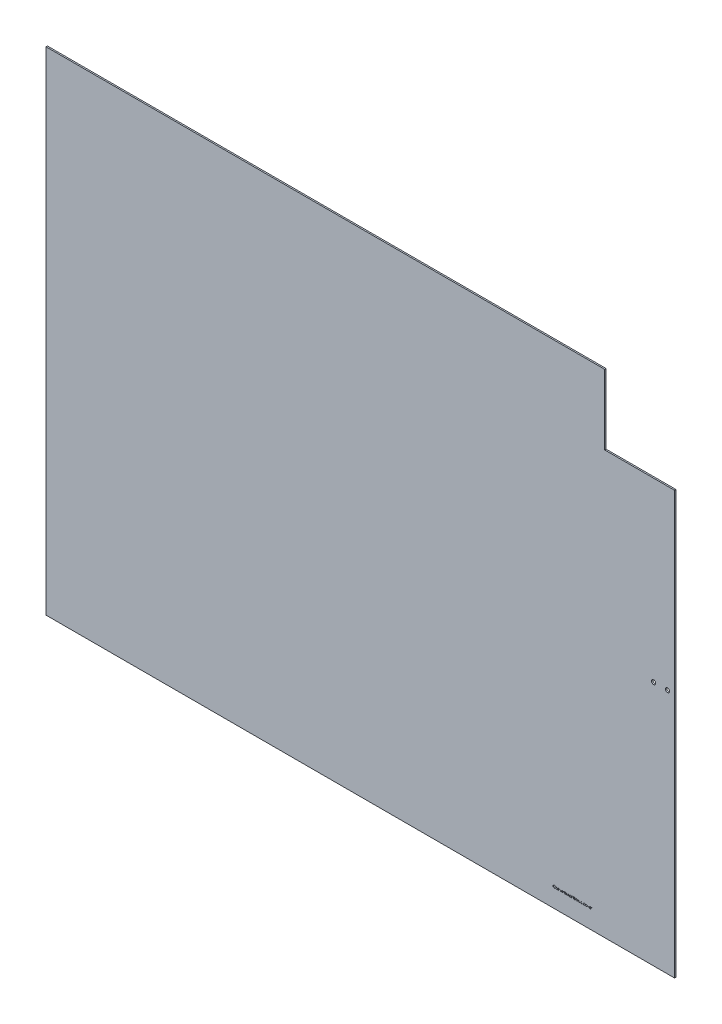
from build123d import *

# Parameters (mm, degrees)
SKETCH1_W           = 900
SKETCH1_H           = 705
BOSS_EXTRUDE1_DEPTH = 2
SKETCH2_W           = 100
SKETCH2_H           = 100
CUT_EXTRUDE1_DEPTH  = 1144.253690132
CUT_EXTRUDE2_DEPTH  = 1144.253690132
SKETCH4_R           = 3
CUT_EXTRUDE3_DEPTH  = 1144.253690272


with BuildPart() as part:
    # Sketch1 → Boss-Extrude1 (new body)
    with BuildSketch(Plane.XY):
        with Locations((450, 352.5)):
            Rectangle(SKETCH1_W, SKETCH1_H)
    extrude(amount=BOSS_EXTRUDE1_DEPTH)

    # Sketch2 → Cut-Extrude1 (cut, through all)
    with BuildSketch(Plane.XY.offset(2)):
        with Locations((850, 655)):
            Rectangle(SKETCH2_W, SKETCH2_H)
    extrude(amount=-CUT_EXTRUDE1_DEPTH, mode=Mode.SUBTRACT)

    # Sketch3 → Cut-Extrude2 (cut, through all)
    # profile 1 of 19: a face of its own
    with BuildSketch(Plane.XY.offset(2)):
        with BuildLine():
            Line((729.46315106, 28.439931075), (729.188311316, 28.229594537))
            add(Edge.make_bspline(
                [(729.188311316, 28.229594537), (729.150060387, 28.276564336), (729.089438974, 28.343770671), (729.001785957, 28.425613348), (728.933880991, 28.482866497), (728.862118106, 28.534280149), (728.788258306, 28.582552508), (728.711060005, 28.625818299), (728.604308291, 28.678290075), (728.464660929, 28.732969047), (728.227188451, 28.795357634), (728.041644181, 28.81353581), (727.91647638, 28.81292787)],
                knots=[0, 0, 0, 0, 0.125474941, 0.18712122, 0.248294346, 0.309294856, 0.369850066, 0.430973376, 0.49245599, 0.616147966, 0.740843698, 1, 1, 1, 1], degree=3))
            add(Edge.make_bspline(
                [(727.91647638, 28.81292787), (727.84659493, 28.813847822), (727.742611962, 28.806349263), (727.606191207, 28.786171979), (727.506478924, 28.764081442), (727.408896185, 28.736099494), (727.312803724, 28.702676567), (727.21959314, 28.661321057), (727.127974898, 28.615612979), (727.040195688, 28.563985485), (726.95714064, 28.507672146), (726.879112672, 28.447303046), (726.80605006, 28.382651941), (726.737878112, 28.31400998), (726.675090798, 28.240645639), (726.6179054, 28.162793465), (726.56518833, 28.081480058), (726.517975762, 27.996942264), (726.478445271, 27.908867204), (726.443442435, 27.81876306), (726.415734538, 27.725612055), (726.393842642, 27.630068703), (726.373312418, 27.497897688), (726.366143893, 27.396892017), (726.366997213, 27.32865303)],
                knots=[0, 0, 0, 0, 0.087501875, 0.130462627, 0.172752021, 0.215403067, 0.25764983, 0.300152749, 0.34312149, 0.385925163, 0.427685727, 0.46881795, 0.5094918, 0.549883031, 0.589980023, 0.63040523, 0.670868626, 0.711383944, 0.751627258, 0.791775577, 0.832458919, 0.873319045, 0.914542956, 1, 1, 1, 1], degree=3))
            add(Edge.make_bspline(
                [(726.366997213, 27.32865303), (726.366531332, 27.227051364), (726.38068322, 27.076999876), (726.426334591, 26.884063359), (726.476493554, 26.748682861), (726.53842771, 26.618774679), (726.616664232, 26.496535773), (726.707281893, 26.380119241), (726.811556001, 26.272276215), (726.925961901, 26.173762771), (727.048709792, 26.087011158), (727.17949408, 26.014700082), (727.31687073, 25.954509814), (727.461896761, 25.908307868), (727.668571378, 25.863863534), (727.829246217, 25.850512775), (727.938211156, 25.851389408)],
                knots=[0, 0, 0, 0, 0.126290104, 0.186726469, 0.246146432, 0.305575643, 0.365429386, 0.426326309, 0.488839906, 0.551724972, 0.613918596, 0.675483766, 0.737333897, 0.800229044, 0.864502298, 1, 1, 1, 1], degree=3))
            add(Edge.make_bspline(
                [(727.938211156, 25.851389408), (728.058385361, 25.851356081), (728.236886462, 25.868304922), (728.464781316, 25.930273367), (728.626103606, 25.994096247), (728.779395587, 26.077212674), (728.976971752, 26.213525299), (729.107600917, 26.341891424), (729.188311316, 26.434722742)],
                knots=[0, 0, 0, 0, 0.252948636, 0.374754734, 0.495939754, 0.617180641, 0.740909469, 1, 1, 1, 1], degree=3))
            Line((729.188311316, 26.434722742), (729.46315106, 26.226489569))
            add(Edge.make_bspline(
                [(729.46315106, 26.226489569), (729.419847813, 26.168943109), (729.351018417, 26.086265155), (729.250154007, 25.985244953), (729.170515243, 25.91510491), (729.087392893, 25.848953786), (728.999321807, 25.788651054), (728.907452443, 25.733360422), (728.812098054, 25.682733395), (728.713359415, 25.637816305), (728.611354994, 25.599362008), (728.506524389, 25.566239104), (728.398862987, 25.538979616), (728.288146829, 25.517737184), (728.135330857, 25.498421709), (728.018776326, 25.491844911), (727.940314521, 25.492415049)],
                knots=[0, 0, 0, 0, 0.123053062, 0.183475001, 0.243726501, 0.304278917, 0.364862921, 0.425946204, 0.48739123, 0.549220384, 0.611143589, 0.67352853, 0.736961457, 0.800785283, 0.866012596, 1, 1, 1, 1], degree=3))
            add(Edge.make_bspline(
                [(727.940314521, 25.492415049), (727.865849311, 25.491486876), (727.755765119, 25.497458528), (727.611347283, 25.513059117), (727.507572088, 25.530271379), (727.406446262, 25.550622971), (727.308885637, 25.577892339), (727.213930443, 25.608442006), (727.121962074, 25.64434684), (727.032902472, 25.684863141), (726.947038301, 25.730654381), (726.864411206, 25.781337402), (726.784200798, 25.835788108), (726.707621895, 25.895781532), (726.608749921, 25.982424471), (726.539785245, 26.053843629), (726.496704745, 26.104494376)],
                knots=[0, 0, 0, 0, 0.137749562, 0.203916744, 0.268779862, 0.332413706, 0.39475354, 0.456180032, 0.516995649, 0.577395938, 0.637198344, 0.696999184, 0.756756194, 0.816553905, 0.876947997, 1, 1, 1, 1], degree=3))
            add(Edge.make_bspline(
                [(726.496704745, 26.104494376), (726.424170884, 26.189232781), (726.326693716, 26.325020627), (726.223589447, 26.52137605), (726.161155793, 26.674758377), (726.112459825, 26.834796059), (726.066485279, 27.060250614), (726.052546429, 27.234649043), (726.052894649, 27.352491171)],
                knots=[0, 0, 0, 0, 0.247156016, 0.368779749, 0.490733862, 0.613613772, 0.738957576, 1, 1, 1, 1], degree=3))
            add(Edge.make_bspline(
                [(726.052894649, 27.352491171), (726.052831725, 27.476293351), (726.068524922, 27.659792976), (726.125371986, 27.895233801), (726.184708421, 28.061436408), (726.260029848, 28.22056699), (726.3530521, 28.371408118), (726.462720437, 28.51492492), (726.588167674, 28.648939743), (726.725735094, 28.771478805), (726.873053905, 28.879286069), (727.02983578, 28.968999676), (727.194353926, 29.044010487), (727.367838484, 29.101599383), (727.614412284, 29.156533559), (727.806304509, 29.171650039), (727.93610779, 29.171902229)],
                knots=[0, 0, 0, 0, 0.127013532, 0.18795481, 0.248013913, 0.307747682, 0.368234515, 0.429469844, 0.492743437, 0.556257769, 0.618216786, 0.679655476, 0.741245546, 0.803415265, 0.866815462, 1, 1, 1, 1], degree=3))
            add(Edge.make_bspline(
                [(727.93610779, 29.171902229), (728.015686806, 29.17205312), (728.133810228, 29.166648428), (728.288318071, 29.145628891), (728.399928634, 29.124534412), (728.50905136, 29.098321422), (728.614851573, 29.064182623), (728.717950263, 29.025145692), (728.817697186, 28.980187341), (728.913613674, 28.929720536), (729.005670223, 28.874305052), (729.093134233, 28.814008757), (729.176626205, 28.749347379), (729.254730758, 28.678942111), (729.354982344, 28.579803305), (729.42095811, 28.496658387), (729.46315106, 28.439931075)],
                knots=[0, 0, 0, 0, 0.135682946, 0.20121499, 0.265682235, 0.329266835, 0.392395428, 0.455069762, 0.51712685, 0.578790035, 0.639739863, 0.700191504, 0.759806243, 0.819628319, 0.879354791, 1, 1, 1, 1], degree=3))
        make_face()
    # profile 2 of 19: a face of its own
    with BuildSketch(Plane.XY.offset(2)):
        with BuildLine():
            Line((733.277253624, 28.139850947), (733.591356188, 28.139850947))
            Line((733.591356188, 28.139850947), (733.591356188, 27.695339729))
            add(Edge.make_bspline(
                [(733.591356188, 27.695339729), (733.644041623, 27.770787771), (733.750428079, 27.903665342), (733.880437399, 28.01379489), (733.946123816, 28.05501521)],
                knots=[0, 0, 0, 0, 0.543394841, 1, 1, 1, 1], degree=3))
            add(Edge.make_bspline(
                [(733.946123816, 28.05501521), (734.027713039, 28.097144844), (734.199528614, 28.163829764), (734.382662123, 28.184027105), (734.473367406, 28.184722742)],
                knots=[0, 0, 0, 0, 0.50303512, 1, 1, 1, 1], degree=3))
            add(Edge.make_bspline(
                [(734.473367406, 28.184722742), (734.534427602, 28.183936388), (734.626051794, 28.176184245), (734.743839909, 28.144861732), (734.828452403, 28.112480919), (734.908173409, 28.073227238), (734.981262798, 28.027179361), (735.046885977, 27.975481592), (735.105015903, 27.91580367), (735.157269387, 27.846463463), (735.225017724, 27.732697318), (735.263821252, 27.635647733), (735.28736981, 27.56703444)],
                knots=[0, 0, 0, 0, 0.16653232, 0.248836331, 0.331246145, 0.412957109, 0.490494278, 0.566155792, 0.639987335, 0.716765488, 0.802143905, 1, 1, 1, 1], degree=3))
            add(Edge.make_bspline(
                [(735.28736981, 27.56703444), (735.313492214, 27.616147378), (735.356520409, 27.686548977), (735.420849263, 27.773671176), (735.470867442, 27.833686353), (735.523296259, 27.888993663), (735.57835657, 27.939790734), (735.635741608, 27.986288654), (735.715533904, 28.040622257), (735.819345466, 28.098247096), (735.993914568, 28.165379109), (736.13310806, 28.184944961), (736.225470771, 28.184722742)],
                knots=[0, 0, 0, 0, 0.141225536, 0.209115852, 0.274839653, 0.33948293, 0.402476267, 0.464941889, 0.526832641, 0.647414816, 0.765561512, 1, 1, 1, 1], degree=3))
            add(Edge.make_bspline(
                [(736.225470771, 28.184722742), (736.309135447, 28.184102225), (736.434151057, 28.170388487), (736.588398479, 28.11237009), (736.693870507, 28.054186145), (736.789031663, 27.980993745), (736.871747615, 27.893928437), (736.94151807, 27.793584845), (736.987096706, 27.699193102), (737.018011928, 27.615857734), (737.037073323, 27.54485145), (737.053912331, 27.466699897), (737.067896475, 27.381309627), (737.078102919, 27.288379058), (737.088628282, 27.149834267), (737.091746102, 27.041938303), (737.091356188, 26.967575306)],
                knots=[0, 0, 0, 0, 0.147965015, 0.218796999, 0.289470445, 0.359724218, 0.429707739, 0.50049652, 0.57442902, 0.613947296, 0.65715527, 0.70397277, 0.754938985, 0.809706611, 0.868832954, 1, 1, 1, 1], degree=3))
            Line((737.091356188, 26.967575306), (737.091356188, 25.582158639))
            Line((737.091356188, 25.582158639), (736.777253624, 25.582158639))
            Line((736.777253624, 25.582158639), (736.777253624, 26.968977549))
            add(Edge.make_bspline(
                [(736.777253624, 26.968977549), (736.77732496, 27.031847173), (736.776364431, 27.12217278), (736.769254457, 27.237103071), (736.76332308, 27.311274948), (736.755078532, 27.377523784), (736.744432766, 27.435716193), (736.73315505, 27.486310001), (736.714419067, 27.542396073), (736.68447118, 27.604266111), (736.638853664, 27.67099039), (736.581383698, 27.729068544), (736.515022994, 27.7794972), (736.43947667, 27.820450763), (736.325621759, 27.860691837), (736.233289306, 27.871020689), (736.170783271, 27.870620178)],
                knots=[0, 0, 0, 0, 0.150563303, 0.216151057, 0.275679792, 0.32870705, 0.375904435, 0.417301898, 0.452692748, 0.517265292, 0.581216568, 0.645321894, 0.712024493, 0.780130045, 0.850218226, 1, 1, 1, 1], degree=3))
            add(Edge.make_bspline(
                [(736.170783271, 27.870620178), (736.09224609, 27.871966245), (735.97524388, 27.852685272), (735.828296181, 27.7946807), (735.726078149, 27.732337732), (735.632051143, 27.657505166), (735.551151357, 27.568561972), (735.484319228, 27.467930305), (735.439065237, 27.374784037), (735.410475941, 27.291114531), (735.391599014, 27.218017168), (735.376915668, 27.134935624), (735.363144944, 27.042428007), (735.354158054, 26.939858377), (735.342792904, 26.783870588), (735.341836012, 26.661641229), (735.341356188, 26.577050466)],
                knots=[0, 0, 0, 0, 0.134706602, 0.201864998, 0.270788266, 0.340024294, 0.408082739, 0.476813195, 0.547346064, 0.585639795, 0.628864953, 0.677153203, 0.730802811, 0.789806616, 0.854325009, 1, 1, 1, 1], degree=3))
            Line((735.341356188, 26.577050466), (735.341356188, 25.582158639))
            Line((735.341356188, 25.582158639), (735.027253624, 25.582158639))
            Line((735.027253624, 25.582158639), (735.027253624, 26.882739569))
            add(Edge.make_bspline(
                [(735.027253624, 26.882739569), (735.02730984, 26.953319803), (735.026385137, 27.054621165), (735.019255948, 27.183342067), (735.013378453, 27.266163326), (735.004917586, 27.3395747), (734.995307974, 27.40396945), (734.983959332, 27.459186197), (734.965169453, 27.519749605), (734.936454999, 27.586470374), (734.890266667, 27.657612013), (734.83265935, 27.719877805), (734.76508746, 27.77304541), (734.689085673, 27.816952885), (734.574707173, 27.860241759), (734.481349023, 27.870093011), (734.418679906, 27.870620178)],
                knots=[0, 0, 0, 0, 0.158778855, 0.227738062, 0.289945653, 0.345498839, 0.393896337, 0.436373785, 0.472122274, 0.536383616, 0.599077902, 0.661948234, 0.726310542, 0.791771103, 0.858647304, 1, 1, 1, 1], degree=3))
            add(Edge.make_bspline(
                [(734.418679906, 27.870620178), (734.342871982, 27.871252691), (734.22893605, 27.853053806), (734.086111833, 27.795516778), (733.984156176, 27.735939116), (733.89048229, 27.662017604), (733.80847395, 27.575108685), (733.739531454, 27.476258031), (733.693799601, 27.384093922), (733.664301202, 27.302520586), (733.644705604, 27.233169661), (733.627867114, 27.156169371), (733.615348279, 27.071282418), (733.603288061, 26.979060667), (733.595095022, 26.840533619), (733.590360332, 26.732794375), (733.591356188, 26.658380594)],
                knots=[0, 0, 0, 0, 0.136870959, 0.206114357, 0.277538182, 0.349771978, 0.421250836, 0.492910757, 0.567026589, 0.606614153, 0.649703954, 0.69730315, 0.74908566, 0.804880647, 0.865485006, 1, 1, 1, 1], degree=3))
            Line((733.591356188, 26.658380594), (733.591356188, 25.582158639))
            Line((733.591356188, 25.582158639), (733.277253624, 25.582158639))
            Line((733.277253624, 25.582158639), (733.277253624, 28.139850947))
        make_face()
    # profile 3 of 19: a face of its own
    with BuildSketch(Plane.XY.offset(2)):
        with BuildLine():
            Line((737.809304906, 28.139850947), (738.12340747, 28.139850947))
            Line((738.12340747, 28.139850947), (738.12340747, 27.666593735))
            add(Edge.make_bspline(
                [(738.12340747, 27.666593735), (738.185572705, 27.751903183), (738.290000397, 27.867836762), (738.451278476, 27.992008003), (738.578394246, 28.063437567), (738.712827453, 28.117201324), (738.904062613, 28.171350526), (739.055140332, 28.184401295), (739.156860995, 28.184722742)],
                knots=[0, 0, 0, 0, 0.263044683, 0.386061082, 0.505770653, 0.625178031, 0.746147722, 1, 1, 1, 1], degree=3))
            add(Edge.make_bspline(
                [(739.156860995, 28.184722742), (739.246493726, 28.183824619), (739.379777345, 28.173864881), (739.551211439, 28.13309686), (739.672777797, 28.089729356), (739.790041314, 28.036064969), (739.901263295, 27.96835035), (740.008176869, 27.889943492), (740.108093108, 27.799711524), (740.200414259, 27.702083217), (740.280261228, 27.597060893), (740.349130291, 27.488098422), (740.404811006, 27.373505895), (740.448380395, 27.254188294), (740.490354629, 27.086442815), (740.501099523, 26.955836629), (740.501612598, 26.868016011)],
                knots=[0, 0, 0, 0, 0.128636051, 0.190652902, 0.252125037, 0.313446276, 0.375227279, 0.438498083, 0.5032851, 0.568009687, 0.630878982, 0.692153504, 0.75255215, 0.813191094, 0.8739854, 1, 1, 1, 1], degree=3))
            add(Edge.make_bspline(
                [(740.501612598, 26.868016011), (740.501409359, 26.778506761), (740.489888546, 26.645819556), (740.449234177, 26.475098853), (740.406219373, 26.35382219), (740.350566255, 26.237838379), (740.282864841, 26.127232022), (740.202977511, 26.022038323), (740.111676621, 25.923685364), (740.012623627, 25.833086282), (739.906746133, 25.753847376), (739.795687279, 25.687309041), (739.680014833, 25.63171492), (739.558740245, 25.589864538), (739.388453118, 25.548913753), (739.255924311, 25.537609561), (739.166676701, 25.537286844)],
                knots=[0, 0, 0, 0, 0.128034164, 0.189573725, 0.250579835, 0.311733221, 0.37325008, 0.435762516, 0.500345561, 0.564949367, 0.627527909, 0.68915729, 0.749865012, 0.8107602, 0.872299761, 1, 1, 1, 1], degree=3))
            add(Edge.make_bspline(
                [(739.166676701, 25.537286844), (739.066206492, 25.536126931), (738.917702698, 25.553290125), (738.727378319, 25.605855437), (738.593176797, 25.662473406), (738.465044466, 25.734775396), (738.299981407, 25.854275503), (738.190948799, 25.965460869), (738.12340747, 26.045600146)],
                knots=[0, 0, 0, 0, 0.250547782, 0.371230204, 0.49211577, 0.613400988, 0.73799732, 1, 1, 1, 1], degree=3))
            Line((738.12340747, 26.045600146), (738.12340747, 24.639850947))
            Line((738.12340747, 24.639850947), (737.809304906, 24.639850947))
            Line((737.809304906, 24.639850947), (737.809304906, 28.139850947))
        make_face()
        with BuildLine():
            add(Edge.make_bspline(
                [(739.154056508, 27.870620178), (739.083950859, 27.871653125), (738.98052411, 27.861582608), (738.84686321, 27.831972592), (738.752740122, 27.799105101), (738.662489807, 27.758694542), (738.576805559, 27.708215681), (738.495748026, 27.648562809), (738.419520942, 27.580883701), (738.350657826, 27.506308953), (738.28969426, 27.426721149), (738.238489292, 27.342221045), (738.195978617, 27.253595537), (738.163667883, 27.160150803), (738.13245468, 27.027979543), (738.123604513, 26.924923167), (738.12340747, 26.855395819)],
                knots=[0, 0, 0, 0, 0.130023749, 0.192374057, 0.253884304, 0.314896085, 0.375805828, 0.438242236, 0.501591268, 0.56488076, 0.626533341, 0.687515765, 0.748105916, 0.808795537, 0.870821519, 1, 1, 1, 1], degree=3))
            add(Edge.make_bspline(
                [(738.12340747, 26.855395819), (738.123574671, 26.764618947), (738.138705711, 26.629526333), (738.194733482, 26.459692128), (738.253204093, 26.342233003), (738.327167136, 26.234249952), (738.416261144, 26.137558301), (738.519704781, 26.052772221), (738.635771867, 25.981333329), (738.760193286, 25.923411744), (738.933345225, 25.867703535), (739.068833002, 25.851558973), (739.158964361, 25.851389408)],
                knots=[0, 0, 0, 0, 0.169344011, 0.251060671, 0.332326431, 0.413189279, 0.494299499, 0.57665388, 0.661784919, 0.74776493, 0.831967435, 1, 1, 1, 1], degree=3))
            add(Edge.make_bspline(
                [(739.158964361, 25.851389408), (739.247445174, 25.850853116), (739.379618405, 25.868749302), (739.548542929, 25.923679109), (739.668725009, 25.983161157), (739.781547692, 26.056172105), (739.883430533, 26.143726661), (739.972433058, 26.245217819), (740.048314061, 26.358226977), (740.109383842, 26.479398521), (740.170636812, 26.64582212), (740.186505329, 26.77768886), (740.187510034, 26.864510402)],
                knots=[0, 0, 0, 0, 0.165573796, 0.248158777, 0.332033307, 0.416257349, 0.49952535, 0.58303856, 0.668595904, 0.75403535, 0.8369197, 1, 1, 1, 1], degree=3))
            add(Edge.make_bspline(
                [(740.187510034, 26.864510402), (740.188741568, 26.952030715), (740.169139784, 27.082951419), (740.111638578, 27.250381922), (740.049170564, 27.369905905), (739.974944759, 27.48267878), (739.885204137, 27.582234002), (739.784586418, 27.669400502), (739.671897024, 27.741431426), (739.550959065, 27.798658834), (739.379932054, 27.855207953), (739.244557932, 27.870225203), (739.154056508, 27.870620178)],
                knots=[0, 0, 0, 0, 0.163349297, 0.245826474, 0.33036716, 0.415198374, 0.497940932, 0.580476126, 0.663740011, 0.747512837, 0.830398741, 1, 1, 1, 1], degree=3))
        make_face(mode=Mode.SUBTRACT)
    # profile 4 of 19: a face of its own
    with BuildSketch(Plane.XY.offset(2)):
        with BuildLine():
            Line((741.040074136, 28.139850947), (741.354176701, 28.139850947))
            Line((741.354176701, 28.139850947), (741.354176701, 27.763348543))
            add(Edge.make_bspline(
                [(741.354176701, 27.763348543), (741.397196829, 27.831062502), (741.465149031, 27.924830186), (741.570945924, 28.027521247), (741.648581787, 28.086049527), (741.728962818, 28.129809866), (741.83653611, 28.172487075), (741.922094705, 28.184333725), (741.978175098, 28.184722742)],
                knots=[0, 0, 0, 0, 0.306112383, 0.438366514, 0.560541455, 0.675317225, 0.786113634, 1, 1, 1, 1], degree=3))
            add(Edge.make_bspline(
                [(741.978175098, 28.184722742), (742.023151551, 28.184373321), (742.119618381, 28.16748032), (742.207271493, 28.123942408), (742.251612598, 28.097082517)],
                knots=[0, 0, 0, 0, 0.463523195, 1, 1, 1, 1], degree=3))
            Line((742.251612598, 28.097082517), (742.079136636, 27.825047261))
            add(Edge.make_bspline(
                [(742.079136636, 27.825047261), (742.050523599, 27.837717595), (741.99905094, 27.860973233), (741.943263785, 27.870297789), (741.918579745, 27.870620178)],
                knots=[0, 0, 0, 0, 0.560229945, 1, 1, 1, 1], degree=3))
            add(Edge.make_bspline(
                [(741.918579745, 27.870620178), (741.867054721, 27.8706867), (741.78817547, 27.851809018), (741.693232358, 27.794973705), (741.635057903, 27.746788746), (741.590016094, 27.700228213), (741.557875667, 27.659582625), (741.52839339, 27.614003107), (741.500221351, 27.564274031), (741.474562419, 27.509542586), (741.441710979, 27.428487741), (741.422189592, 27.364009861), (741.410266444, 27.319538447)],
                knots=[0, 0, 0, 0, 0.191338128, 0.295190617, 0.410312337, 0.471930251, 0.536425159, 0.603118728, 0.674117672, 0.749332023, 0.828283384, 1, 1, 1, 1], degree=3))
            add(Edge.make_bspline(
                [(741.410266444, 27.319538447), (741.398516625, 27.274880613), (741.387052671, 27.199708551), (741.374828911, 27.089969168), (741.367680745, 26.987032544), (741.361127594, 26.870416809), (741.355853315, 26.687161231), (741.353630243, 26.542714621), (741.354176701, 26.44173396)],
                knots=[0, 0, 0, 0, 0.15693815, 0.258600395, 0.37589093, 0.508166168, 0.656237809, 1, 1, 1, 1], degree=3))
            Line((741.354176701, 26.44173396), (741.354176701, 25.582158639))
            Line((741.354176701, 25.582158639), (741.040074136, 25.582158639))
            Line((741.040074136, 25.582158639), (741.040074136, 28.139850947))
        make_face()
    # profile 5 of 19: a face of its own
    with BuildSketch(Plane.XY.offset(2)):
        with BuildLine():
            Line((744.664873816, 26.389850947), (744.94392029, 26.243316492))
            add(Edge.make_bspline(
                [(744.94392029, 26.243316492), (744.902419454, 26.165623857), (744.832948463, 26.056627971), (744.726002579, 25.926865817), (744.640929587, 25.845119399), (744.551251981, 25.773872449), (744.456521394, 25.711532932), (744.356232078, 25.65841685), (744.250382262, 25.613656158), (744.138083612, 25.579277924), (743.975700339, 25.545952225), (743.848823858, 25.537298004), (743.762530066, 25.537286844)],
                knots=[0, 0, 0, 0, 0.181660766, 0.265874227, 0.346354784, 0.424599862, 0.501903184, 0.579992091, 0.658443431, 0.738672236, 0.821894148, 1, 1, 1, 1], degree=3))
            add(Edge.make_bspline(
                [(743.762530066, 25.537286844), (743.666759386, 25.537325727), (743.525837691, 25.54832201), (743.346605848, 25.591468365), (743.223395795, 25.635394039), (743.108653117, 25.692831666), (743.002152372, 25.762788415), (742.903332827, 25.84492141), (742.815308582, 25.939937654), (742.736064863, 26.041619657), (742.666138444, 26.147575558), (742.607683185, 26.257538674), (742.560122605, 26.370809608), (742.521747208, 26.486671983), (742.485665924, 26.647119128), (742.4768863, 26.770970935), (742.475971572, 26.853993575)],
                knots=[0, 0, 0, 0, 0.139629225, 0.204796697, 0.268134963, 0.329813747, 0.391301398, 0.453433515, 0.51655169, 0.579631271, 0.641118921, 0.701294047, 0.760810336, 0.819931722, 0.878919575, 1, 1, 1, 1], degree=3))
            add(Edge.make_bspline(
                [(742.475971572, 26.853993575), (742.476924861, 26.931787277), (742.484200941, 27.047916137), (742.51582832, 27.198459848), (742.547975753, 27.30734754), (742.589554855, 27.41288779), (742.657727631, 27.550398826), (742.722891464, 27.646468097), (742.770442726, 27.707959921)],
                knots=[0, 0, 0, 0, 0.2537679, 0.377428427, 0.500550841, 0.623295883, 0.746578332, 1, 1, 1, 1], degree=3))
            add(Edge.make_bspline(
                [(742.770442726, 27.707959921), (742.831015786, 27.78368447), (742.929783762, 27.889566306), (743.084445914, 28.000328833), (743.206022937, 28.068368378), (743.336364372, 28.120000908), (743.522910398, 28.172495311), (743.670786195, 28.183524161), (743.770242406, 28.184722742)],
                knots=[0, 0, 0, 0, 0.253589335, 0.374643257, 0.495340042, 0.616324775, 0.739759335, 1, 1, 1, 1], degree=3))
            add(Edge.make_bspline(
                [(743.770242406, 28.184722742), (743.873069908, 28.185154715), (744.024978168, 28.17027451), (744.217571232, 28.116985259), (744.351415577, 28.061899628), (744.477085089, 27.990687881), (744.635360265, 27.871617096), (744.738803179, 27.761977406), (744.800190322, 27.681317293)],
                knots=[0, 0, 0, 0, 0.259032841, 0.381879824, 0.502258444, 0.62275219, 0.744742632, 1, 1, 1, 1], degree=3))
            add(Edge.make_bspline(
                [(744.800190322, 27.681317293), (744.846076974, 27.62242847), (744.905986015, 27.526789306), (744.969596783, 27.390003284), (745.00797356, 27.281121551), (745.038983693, 27.1672952), (745.069585177, 27.004939081), (745.07694621, 26.878956742), (745.078535675, 26.793697101)],
                knots=[0, 0, 0, 0, 0.236254763, 0.356174434, 0.477249655, 0.601539871, 0.729618382, 1, 1, 1, 1], degree=3))
            Line((745.078535675, 26.793697101), (742.790074136, 26.793697101))
            add(Edge.make_bspline(
                [(742.790074136, 26.793697101), (742.791862861, 26.72745109), (742.800743207, 26.629594831), (742.831023738, 26.50438154), (742.862269503, 26.41729896), (742.900142417, 26.334368713), (742.946526514, 26.256206705), (743.001866507, 26.18316878), (743.063592086, 26.114601593), (743.132299216, 26.053541021), (743.204581945, 25.998888557), (743.281475547, 25.953085482), (743.3623735, 25.91589622), (743.447145775, 25.886825149), (743.56712784, 25.859758689), (743.660256091, 25.851039724), (743.723267245, 25.851389408)],
                knots=[0, 0, 0, 0, 0.134475588, 0.198391058, 0.260753477, 0.321829223, 0.383037238, 0.444653123, 0.507398011, 0.569825238, 0.630777641, 0.690928687, 0.750945133, 0.811049477, 0.872330853, 1, 1, 1, 1], degree=3))
            add(Edge.make_bspline(
                [(743.723267245, 25.851389408), (743.785461149, 25.851088578), (743.878757382, 25.858411639), (744.000605675, 25.883931221), (744.089866418, 25.909789498), (744.17543723, 25.941374728), (744.254683129, 25.979475241), (744.327562073, 26.021626383), (744.395683691, 26.069832741), (744.461735531, 26.128854066), (744.55523332, 26.233672997), (744.62234909, 26.323303463), (744.664873816, 26.389850947)],
                knots=[0, 0, 0, 0, 0.163878894, 0.24565874, 0.327725695, 0.408609961, 0.485749086, 0.559169056, 0.630268476, 0.705306028, 0.792064966, 1, 1, 1, 1], degree=3))
        make_face()
        with BuildLine():
            Line((742.823026861, 27.107799665), (744.764433111, 27.107799665))
            add(Edge.make_bspline(
                [(744.764433111, 27.107799665), (744.744559312, 27.188540679), (744.704943935, 27.302461943), (744.632472549, 27.439371878), (744.570886836, 27.524960431), (744.501058823, 27.600961394), (744.420416228, 27.667381653), (744.329979467, 27.726794807), (744.230221125, 27.776963659), (744.124577011, 27.819591147), (743.97676953, 27.85815707), (743.862810612, 27.871761174), (743.786368207, 27.870620178)],
                knots=[0, 0, 0, 0, 0.185231261, 0.267500523, 0.344400382, 0.419594869, 0.496890627, 0.576637919, 0.660267852, 0.745386615, 0.830040327, 1, 1, 1, 1], degree=3))
            add(Edge.make_bspline(
                [(743.786368207, 27.870620178), (743.724442849, 27.870772315), (743.632408956, 27.864075611), (743.51406679, 27.838347965), (743.429358963, 27.812412299), (743.348750659, 27.777785729), (743.243730633, 27.723370146), (743.172830589, 27.669127537), (743.12731372, 27.630836524)],
                knots=[0, 0, 0, 0, 0.259141276, 0.384161763, 0.505991952, 0.629098089, 0.750669123, 1, 1, 1, 1], degree=3))
            add(Edge.make_bspline(
                [(743.12731372, 27.630836524), (743.09243304, 27.60145401), (743.045226666, 27.55057184), (742.988497171, 27.47579257), (742.949134466, 27.412775867), (742.913076184, 27.344144271), (742.866857953, 27.243524426), (742.839461067, 27.163131507), (742.823026861, 27.107799665)],
                knots=[0, 0, 0, 0, 0.222580497, 0.338499871, 0.458708565, 0.585535346, 0.717517743, 1, 1, 1, 1], degree=3))
        make_face(mode=Mode.SUBTRACT)
    # profile 6 of 19: a face of its own
    with BuildSketch(Plane.XY.offset(2)):
        with BuildLine():
            Line((746.918279265, 27.82084053), (746.705138239, 27.601389408))
            add(Edge.make_bspline(
                [(746.705138239, 27.601389408), (746.670320918, 27.642918435), (746.616851921, 27.700862662), (746.539029846, 27.764857313), (746.483991222, 27.803829132), (746.428529802, 27.833233682), (746.356466894, 27.861479309), (746.300246382, 27.870587412), (746.263431508, 27.870620178)],
                knots=[0, 0, 0, 0, 0.305035505, 0.441308964, 0.565963227, 0.683525114, 0.79333413, 1, 1, 1, 1], degree=3))
            add(Edge.make_bspline(
                [(746.263431508, 27.870620178), (746.21978173, 27.871514921), (746.15467531, 27.857421919), (746.077352662, 27.8138554), (746.027180355, 27.767953452), (745.98474325, 27.715172908), (745.943055685, 27.636319048), (745.93122327, 27.570314028), (745.931099777, 27.526369376)],
                knots=[0, 0, 0, 0, 0.245900629, 0.36916603, 0.498510841, 0.628503866, 0.751028329, 1, 1, 1, 1], degree=3))
            add(Edge.make_bspline(
                [(745.931099777, 27.526369376), (745.931175293, 27.486003843), (745.946861437, 27.401860003), (745.991348691, 27.328827114), (746.01803888, 27.294298062)],
                knots=[0, 0, 0, 0, 0.479403194, 1, 1, 1, 1], degree=3))
            add(Edge.make_bspline(
                [(746.01803888, 27.294298062), (746.03402139, 27.272583574), (746.065230438, 27.243048553), (746.110807121, 27.202864849), (746.15409367, 27.170895937), (746.202861983, 27.137286034), (746.279708701, 27.089874806), (746.339901248, 27.053287399), (746.383323335, 27.030676267)],
                knots=[0, 0, 0, 0, 0.177559821, 0.28398236, 0.402216747, 0.53356848, 0.676120994, 1, 1, 1, 1], degree=3))
            add(Edge.make_bspline(
                [(746.383323335, 27.030676267), (746.436043264, 27.001546118), (746.511896547, 26.957667849), (746.605580833, 26.894836837), (746.667045758, 26.85017955), (746.720964339, 26.805009299), (746.782659856, 26.748807014), (746.821795722, 26.702998252), (746.843960354, 26.671701908)],
                knots=[0, 0, 0, 0, 0.307114592, 0.446213159, 0.574876072, 0.69415211, 0.80458118, 1, 1, 1, 1], degree=3))
            add(Edge.make_bspline(
                [(746.843960354, 26.671701908), (746.882014584, 26.614167677), (746.946091436, 26.48751653), (746.962150055, 26.346513142), (746.96315106, 26.276269216)],
                knots=[0, 0, 0, 0, 0.495235025, 1, 1, 1, 1], degree=3))
            add(Edge.make_bspline(
                [(746.96315106, 26.276269216), (746.962679157, 26.226541273), (746.957181136, 26.152466738), (746.934186069, 26.057734033), (746.911110716, 25.990040064), (746.87992139, 25.926080771), (746.843374924, 25.864244615), (746.799499647, 25.805868665), (746.749408372, 25.751029684), (746.694562855, 25.700944041), (746.636056709, 25.656919706), (746.573817931, 25.620346766), (746.508290926, 25.590076184), (746.439328048, 25.566027848), (746.341335845, 25.543376352), (746.265041347, 25.537636943), (746.213651861, 25.537286844)],
                knots=[0, 0, 0, 0, 0.127199133, 0.188597338, 0.248639515, 0.309524699, 0.370036991, 0.431889244, 0.495704286, 0.559519328, 0.62137158, 0.682397107, 0.743568482, 0.805498484, 0.868639701, 1, 1, 1, 1], degree=3))
            add(Edge.make_bspline(
                [(746.213651861, 25.537286844), (746.143391851, 25.536753825), (746.038193022, 25.548879566), (745.902633885, 25.587596603), (745.804238889, 25.627250192), (745.711233865, 25.677448075), (745.597993003, 25.757039733), (745.52464962, 25.830042109), (745.482381829, 25.883641011)],
                knots=[0, 0, 0, 0, 0.251723961, 0.377218688, 0.504693549, 0.631458239, 0.755401067, 1, 1, 1, 1], degree=3))
            Line((745.482381829, 25.883641011), (745.690615002, 26.120620178))
            add(Edge.make_bspline(
                [(745.690615002, 26.120620178), (745.728264923, 26.078725083), (745.786558267, 26.020035592), (745.872409124, 25.956549695), (745.935232051, 25.917886257), (745.999455826, 25.888153941), (746.085917561, 25.860236664), (746.153069877, 25.851174221), (746.19752606, 25.851389408)],
                knots=[0, 0, 0, 0, 0.285904172, 0.417171648, 0.540500744, 0.659237718, 0.775006098, 1, 1, 1, 1], degree=3))
            add(Edge.make_bspline(
                [(746.19752606, 25.851389408), (746.256734267, 25.850876978), (746.344553915, 25.866164206), (746.450258415, 25.917936961), (746.518303127, 25.971956808), (746.576126286, 26.034929065), (746.632262976, 26.129250372), (746.64937975, 26.209729341), (746.649048495, 26.262947902)],
                knots=[0, 0, 0, 0, 0.261895674, 0.387836045, 0.517686206, 0.644508654, 0.764718263, 1, 1, 1, 1], degree=3))
            add(Edge.make_bspline(
                [(746.649048495, 26.262947902), (746.648881145, 26.30691752), (746.63488961, 26.395207759), (746.590700037, 26.472987577), (746.562810515, 26.506938287)],
                knots=[0, 0, 0, 0, 0.500453315, 1, 1, 1, 1], degree=3))
            add(Edge.make_bspline(
                [(746.562810515, 26.506938287), (746.545963517, 26.527205516), (746.514764073, 26.556613665), (746.466858235, 26.594703081), (746.421741102, 26.627056687), (746.369741653, 26.660643403), (746.287085473, 26.709248293), (746.221460055, 26.746103079), (746.175090162, 26.770560081)],
                knots=[0, 0, 0, 0, 0.167461676, 0.272270023, 0.389550841, 0.520801368, 0.666263293, 1, 1, 1, 1], degree=3))
            add(Edge.make_bspline(
                [(746.175090162, 26.770560081), (746.124495946, 26.798527162), (746.051509305, 26.840214209), (745.962439157, 26.901883084), (745.903328709, 26.944785672), (745.851196472, 26.988229232), (745.793282745, 27.044594616), (745.755023633, 27.088651476), (745.734084553, 27.119718735)],
                knots=[0, 0, 0, 0, 0.305950213, 0.443775499, 0.572824362, 0.692154156, 0.802295707, 1, 1, 1, 1], degree=3))
            add(Edge.make_bspline(
                [(745.734084553, 27.119718735), (745.694815782, 27.176113529), (745.636441919, 27.304012017), (745.61572544, 27.443030109), (745.616997213, 27.513749184)],
                knots=[0, 0, 0, 0, 0.492590796, 1, 1, 1, 1], degree=3))
            add(Edge.make_bspline(
                [(745.616997213, 27.513749184), (745.617314002, 27.559891497), (745.621442453, 27.628526364), (745.642123621, 27.716101249), (745.661164734, 27.778226294), (745.687651355, 27.836728864), (745.719296294, 27.89238621), (745.756483981, 27.945122152), (745.7993272, 27.994125314), (745.846433866, 28.038634499), (745.897328626, 28.077433643), (745.9508669, 28.11053811), (746.007275259, 28.138310301), (746.06709596, 28.159285012), (746.152272964, 28.179028134), (746.218518447, 28.185257305), (746.263431508, 28.184722742)],
                knots=[0, 0, 0, 0, 0.133043535, 0.196507438, 0.258613417, 0.319728338, 0.380872854, 0.442635602, 0.505079304, 0.56788052, 0.628813854, 0.688910091, 0.748765006, 0.809385783, 0.870884336, 1, 1, 1, 1], degree=3))
            add(Edge.make_bspline(
                [(746.263431508, 28.184722742), (746.3183268, 28.184669553), (746.40220956, 28.172978285), (746.51010467, 28.134507719), (746.592433425, 28.094329796), (746.674221876, 28.042228019), (746.787728563, 27.955350316), (746.867671208, 27.878135098), (746.918279265, 27.82084053)],
                knots=[0, 0, 0, 0, 0.213411613, 0.32612673, 0.444451672, 0.56906108, 0.702712204, 1, 1, 1, 1], degree=3))
        make_face()
    # profile 7 of 19: a face of its own
    with BuildSketch(Plane.XY.offset(2)):
        with BuildLine():
            Line((748.802894649, 27.82084053), (748.589753624, 27.601389408))
            add(Edge.make_bspline(
                [(748.589753624, 27.601389408), (748.554936303, 27.642918435), (748.501467305, 27.700862662), (748.42364523, 27.764857313), (748.368606607, 27.803829132), (748.313145186, 27.833233682), (748.241082278, 27.861479309), (748.184861767, 27.870587412), (748.148046893, 27.870620178)],
                knots=[0, 0, 0, 0, 0.305035505, 0.441308964, 0.565963227, 0.683525114, 0.79333413, 1, 1, 1, 1], degree=3))
            add(Edge.make_bspline(
                [(748.148046893, 27.870620178), (748.104397115, 27.871514921), (748.039290695, 27.857421919), (747.961968047, 27.8138554), (747.911795739, 27.767953452), (747.869358635, 27.715172908), (747.827671069, 27.636319048), (747.815838654, 27.570314028), (747.815715162, 27.526369376)],
                knots=[0, 0, 0, 0, 0.245900629, 0.36916603, 0.498510841, 0.628503866, 0.751028329, 1, 1, 1, 1], degree=3))
            add(Edge.make_bspline(
                [(747.815715162, 27.526369376), (747.815790678, 27.486003843), (747.831476822, 27.401860003), (747.875964076, 27.328827114), (747.902654265, 27.294298062)],
                knots=[0, 0, 0, 0, 0.479403194, 1, 1, 1, 1], degree=3))
            add(Edge.make_bspline(
                [(747.902654265, 27.294298062), (747.918636775, 27.272583574), (747.949845822, 27.243048553), (747.995422506, 27.202864849), (748.038709055, 27.170895937), (748.087477367, 27.137286034), (748.164324085, 27.089874806), (748.224516632, 27.053287399), (748.26793872, 27.030676267)],
                knots=[0, 0, 0, 0, 0.177559821, 0.28398236, 0.402216747, 0.53356848, 0.676120994, 1, 1, 1, 1], degree=3))
            add(Edge.make_bspline(
                [(748.26793872, 27.030676267), (748.320658649, 27.001546118), (748.396511931, 26.957667849), (748.490196217, 26.894836837), (748.551661143, 26.85017955), (748.605579723, 26.805009299), (748.66727524, 26.748807014), (748.706411106, 26.702998252), (748.728575739, 26.671701908)],
                knots=[0, 0, 0, 0, 0.307114592, 0.446213159, 0.574876072, 0.69415211, 0.80458118, 1, 1, 1, 1], degree=3))
            add(Edge.make_bspline(
                [(748.728575739, 26.671701908), (748.766629969, 26.614167677), (748.830706821, 26.48751653), (748.846765439, 26.346513142), (748.847766444, 26.276269216)],
                knots=[0, 0, 0, 0, 0.495235025, 1, 1, 1, 1], degree=3))
            add(Edge.make_bspline(
                [(748.847766444, 26.276269216), (748.847294542, 26.226541273), (748.84179652, 26.152466738), (748.818801454, 26.057734033), (748.795726101, 25.990040064), (748.764536775, 25.926080771), (748.727990309, 25.864244615), (748.684115032, 25.805868665), (748.634023757, 25.751029684), (748.579178239, 25.700944041), (748.520672093, 25.656919706), (748.458433315, 25.620346766), (748.39290631, 25.590076184), (748.323943433, 25.566027848), (748.22595123, 25.543376352), (748.149656732, 25.537636943), (748.098267245, 25.537286844)],
                knots=[0, 0, 0, 0, 0.127199133, 0.188597338, 0.248639515, 0.309524699, 0.370036991, 0.431889244, 0.495704286, 0.559519328, 0.62137158, 0.682397107, 0.743568482, 0.805498484, 0.868639701, 1, 1, 1, 1], degree=3))
            add(Edge.make_bspline(
                [(748.098267245, 25.537286844), (748.028007236, 25.536753825), (747.922808407, 25.548879566), (747.78724927, 25.587596603), (747.688854274, 25.627250192), (747.59584925, 25.677448075), (747.482608388, 25.757039733), (747.409265004, 25.830042109), (747.366997213, 25.883641011)],
                knots=[0, 0, 0, 0, 0.251723961, 0.377218688, 0.504693549, 0.631458239, 0.755401067, 1, 1, 1, 1], degree=3))
            Line((747.366997213, 25.883641011), (747.575230386, 26.120620178))
            add(Edge.make_bspline(
                [(747.575230386, 26.120620178), (747.612880307, 26.078725083), (747.671173651, 26.020035592), (747.757024509, 25.956549695), (747.819847435, 25.917886257), (747.88407121, 25.888153941), (747.970532945, 25.860236664), (748.037685262, 25.851174221), (748.082141444, 25.851389408)],
                knots=[0, 0, 0, 0, 0.285904172, 0.417171648, 0.540500744, 0.659237718, 0.775006098, 1, 1, 1, 1], degree=3))
            add(Edge.make_bspline(
                [(748.082141444, 25.851389408), (748.141349652, 25.850876978), (748.2291693, 25.866164206), (748.334873799, 25.917936961), (748.402918512, 25.971956808), (748.460741671, 26.034929065), (748.516878361, 26.129250372), (748.533995135, 26.209729341), (748.53366388, 26.262947902)],
                knots=[0, 0, 0, 0, 0.261895674, 0.387836045, 0.517686206, 0.644508654, 0.764718263, 1, 1, 1, 1], degree=3))
            add(Edge.make_bspline(
                [(748.53366388, 26.262947902), (748.533496529, 26.30691752), (748.519504995, 26.395207759), (748.475315421, 26.472987577), (748.447425899, 26.506938287)],
                knots=[0, 0, 0, 0, 0.500453315, 1, 1, 1, 1], degree=3))
            add(Edge.make_bspline(
                [(748.447425899, 26.506938287), (748.430578902, 26.527205516), (748.399379458, 26.556613665), (748.35147362, 26.594703081), (748.306356486, 26.627056687), (748.254357038, 26.660643403), (748.171700858, 26.709248293), (748.106075439, 26.746103079), (748.059705547, 26.770560081)],
                knots=[0, 0, 0, 0, 0.167461676, 0.272270023, 0.389550841, 0.520801368, 0.666263293, 1, 1, 1, 1], degree=3))
            add(Edge.make_bspline(
                [(748.059705547, 26.770560081), (748.00911133, 26.798527162), (747.93612469, 26.840214209), (747.847054541, 26.901883084), (747.787944094, 26.944785672), (747.735811857, 26.988229232), (747.67789813, 27.044594616), (747.639639017, 27.088651476), (747.618699938, 27.119718735)],
                knots=[0, 0, 0, 0, 0.305950213, 0.443775499, 0.572824362, 0.692154156, 0.802295707, 1, 1, 1, 1], degree=3))
            add(Edge.make_bspline(
                [(747.618699938, 27.119718735), (747.579431167, 27.176113529), (747.521057304, 27.304012017), (747.500340825, 27.443030109), (747.501612598, 27.513749184)],
                knots=[0, 0, 0, 0, 0.492590796, 1, 1, 1, 1], degree=3))
            add(Edge.make_bspline(
                [(747.501612598, 27.513749184), (747.501929387, 27.559891497), (747.506057837, 27.628526364), (747.526739006, 27.716101249), (747.545780118, 27.778226294), (747.572266739, 27.836728864), (747.603911678, 27.89238621), (747.641099365, 27.945122152), (747.683942585, 27.994125314), (747.73104925, 28.038634499), (747.78194401, 28.077433643), (747.835482284, 28.11053811), (747.891890644, 28.138310301), (747.951711344, 28.159285012), (748.036888349, 28.179028134), (748.103133831, 28.185257305), (748.148046893, 28.184722742)],
                knots=[0, 0, 0, 0, 0.133043535, 0.196507438, 0.258613417, 0.319728338, 0.380872854, 0.442635602, 0.505079304, 0.56788052, 0.628813854, 0.688910091, 0.748765006, 0.809385783, 0.870884336, 1, 1, 1, 1], degree=3))
            add(Edge.make_bspline(
                [(748.148046893, 28.184722742), (748.202942185, 28.184669553), (748.286824945, 28.172978285), (748.394720054, 28.134507719), (748.47704881, 28.094329796), (748.558837261, 28.042228019), (748.672343948, 27.955350316), (748.752286592, 27.878135098), (748.802894649, 27.82084053)],
                knots=[0, 0, 0, 0, 0.213411613, 0.32612673, 0.444451672, 0.56906108, 0.702712204, 1, 1, 1, 1], degree=3))
        make_face()
    # profile 8 of 19: a face of its own
    with BuildSketch(Plane.XY.offset(2)):
        with BuildLine():
            Line((752.572125419, 28.139850947), (752.886227983, 28.139850947))
            Line((752.886227983, 28.139850947), (752.886227983, 27.763348543))
            add(Edge.make_bspline(
                [(752.886227983, 27.763348543), (752.929248111, 27.831062502), (752.997200313, 27.924830186), (753.102997206, 28.027521247), (753.180633069, 28.086049527), (753.2610141, 28.129809866), (753.368587392, 28.172487075), (753.454145987, 28.184333725), (753.51022638, 28.184722742)],
                knots=[0, 0, 0, 0, 0.306112383, 0.438366514, 0.560541455, 0.675317225, 0.786113634, 1, 1, 1, 1], degree=3))
            add(Edge.make_bspline(
                [(753.51022638, 28.184722742), (753.555202833, 28.184373321), (753.651669663, 28.16748032), (753.739322775, 28.123942408), (753.78366388, 28.097082517)],
                knots=[0, 0, 0, 0, 0.463523195, 1, 1, 1, 1], degree=3))
            Line((753.78366388, 28.097082517), (753.611187919, 27.825047261))
            add(Edge.make_bspline(
                [(753.611187919, 27.825047261), (753.582574881, 27.837717595), (753.531102223, 27.860973233), (753.475315067, 27.870297789), (753.450631027, 27.870620178)],
                knots=[0, 0, 0, 0, 0.560229945, 1, 1, 1, 1], degree=3))
            add(Edge.make_bspline(
                [(753.450631027, 27.870620178), (753.399106003, 27.8706867), (753.320226752, 27.851809018), (753.22528364, 27.794973705), (753.167109185, 27.746788746), (753.122067376, 27.700228213), (753.089926949, 27.659582625), (753.060444673, 27.614003107), (753.032272633, 27.564274031), (753.006613701, 27.509542586), (752.973762261, 27.428487741), (752.954240874, 27.364009861), (752.942317726, 27.319538447)],
                knots=[0, 0, 0, 0, 0.191338128, 0.295190617, 0.410312337, 0.471930251, 0.536425159, 0.603118728, 0.674117672, 0.749332023, 0.828283384, 1, 1, 1, 1], degree=3))
            add(Edge.make_bspline(
                [(752.942317726, 27.319538447), (752.930567907, 27.274880613), (752.919103953, 27.199708551), (752.906880193, 27.089969168), (752.899732027, 26.987032544), (752.893178876, 26.870416809), (752.887904597, 26.687161231), (752.885681525, 26.542714621), (752.886227983, 26.44173396)],
                knots=[0, 0, 0, 0, 0.15693815, 0.258600395, 0.37589093, 0.508166168, 0.656237809, 1, 1, 1, 1], degree=3))
            Line((752.886227983, 26.44173396), (752.886227983, 25.582158639))
            Line((752.886227983, 25.582158639), (752.572125419, 25.582158639))
            Line((752.572125419, 25.582158639), (752.572125419, 28.139850947))
        make_face()
    # profile 9 of 19: a face of its own
    with BuildSketch(Plane.XY.offset(2)):
        with BuildLine():
            Line((755.44392029, 25.582158639), (755.44392029, 29.171902229))
            Line((755.44392029, 29.171902229), (755.758022854, 29.171902229))
            Line((755.758022854, 29.171902229), (755.758022854, 27.675708319))
            add(Edge.make_bspline(
                [(755.758022854, 27.675708319), (755.824911111, 27.756885276), (755.93433231, 27.868256249), (756.099684177, 27.98785898), (756.227602655, 28.060491364), (756.36230385, 28.115700126), (756.55193464, 28.170455545), (756.701094662, 28.184805418), (756.801292085, 28.184722742)],
                knots=[0, 0, 0, 0, 0.262680826, 0.387189654, 0.508389693, 0.628966193, 0.749723188, 1, 1, 1, 1], degree=3))
            add(Edge.make_bspline(
                [(756.801292085, 28.184722742), (756.890539695, 28.184400024), (757.023068504, 28.173095833), (757.193355628, 28.132145047), (757.314630225, 28.09029467), (757.430302637, 28.03470053), (757.541361622, 27.968162263), (757.64723861, 27.888923098), (757.746293557, 27.798325019), (757.837587194, 27.699968335), (757.917500605, 27.59478803), (757.984997023, 27.484312957), (758.040840375, 27.368912816), (758.083966424, 27.248116762), (758.124376737, 27.077801317), (758.136151807, 26.945394503), (758.136227983, 26.85609694)],
                knots=[0, 0, 0, 0, 0.127821334, 0.189419252, 0.250372186, 0.311137475, 0.372825298, 0.435463182, 0.50012825, 0.564772537, 0.627344253, 0.688919446, 0.7498292, 0.810577905, 0.872175822, 1, 1, 1, 1], degree=3))
            add(Edge.make_bspline(
                [(758.136227983, 26.85609694), (758.135855196, 26.768015714), (758.124813871, 26.63702105), (758.083153639, 26.468709332), (758.039233343, 26.349062266), (757.983957448, 26.234042034), (757.914849151, 26.124961713), (757.835037326, 26.019922727), (757.742706405, 25.922299052), (757.642792799, 25.832065835), (757.535878539, 25.753659303), (757.424656736, 25.685944599), (757.307393172, 25.632280234), (757.185826826, 25.588912725), (757.014392727, 25.548144706), (756.881109112, 25.538184966), (756.79147638, 25.537286844)],
                knots=[0, 0, 0, 0, 0.126227996, 0.187288763, 0.247869473, 0.308511206, 0.369726883, 0.432535801, 0.49719823, 0.561923029, 0.62513307, 0.686854743, 0.748117091, 0.809530192, 0.871487485, 1, 1, 1, 1], degree=3))
            add(Edge.make_bspline(
                [(756.79147638, 25.537286844), (756.689770213, 25.537631878), (756.538650523, 25.550614358), (756.347481777, 25.604871617), (756.212757993, 25.658380001), (756.086366423, 25.730943129), (755.923950124, 25.853513988), (755.821212849, 25.971172366), (755.758022854, 26.055415851)],
                knots=[0, 0, 0, 0, 0.253879762, 0.37486255, 0.494282856, 0.614292714, 0.736970281, 1, 1, 1, 1], degree=3))
            Line((755.758022854, 26.055415851), (755.758022854, 25.582158639))
            Line((755.758022854, 25.582158639), (755.44392029, 25.582158639))
        make_face()
        with BuildLine():
            add(Edge.make_bspline(
                [(756.788671893, 25.851389408), (756.879173122, 25.851784514), (757.014547816, 25.866801379), (757.185573895, 25.923351125), (757.30651451, 25.980576748), (757.419194041, 26.052614298), (757.519848241, 26.139756289), (757.609321422, 26.23925917), (757.683998252, 26.351491569), (757.746231235, 26.470946309), (757.803652092, 26.638136023), (757.823495792, 26.768783849), (757.822125419, 26.85609694)],
                knots=[0, 0, 0, 0, 0.169735574, 0.252687118, 0.336526289, 0.419856114, 0.502456671, 0.585264756, 0.669799831, 0.754407469, 0.836949963, 1, 1, 1, 1], degree=3))
            add(Edge.make_bspline(
                [(757.822125419, 26.85609694), (757.821033633, 26.943354044), (757.805457567, 27.075760818), (757.743990354, 27.242609393), (757.682931859, 27.363783064), (757.607047812, 27.476791648), (757.518046084, 27.578282957), (757.416163032, 27.665837473), (757.303340406, 27.738848432), (757.18315831, 27.798330477), (757.014233791, 27.853260284), (756.882060558, 27.87115647), (756.793579745, 27.870620178)],
                knots=[0, 0, 0, 0, 0.163804915, 0.246617502, 0.331982974, 0.417466241, 0.500907145, 0.584103052, 0.668254172, 0.752056082, 0.83456956, 1, 1, 1, 1], degree=3))
            add(Edge.make_bspline(
                [(756.793579745, 27.870620178), (756.703256897, 27.871169652), (756.568102706, 27.853210084), (756.394638322, 27.798079805), (756.270348997, 27.739227191), (756.154495694, 27.66709483), (756.0508819, 27.582359949), (755.961554262, 27.485578862), (755.887995991, 27.377072597), (755.829645247, 27.259890584), (755.772923586, 27.090988628), (755.758463909, 26.956387724), (755.758022854, 26.865912646)],
                knots=[0, 0, 0, 0, 0.168181784, 0.252418528, 0.338617797, 0.424014102, 0.506401971, 0.587545174, 0.668800722, 0.750099527, 0.83102227, 1, 1, 1, 1], degree=3))
            add(Edge.make_bspline(
                [(755.758022854, 26.865912646), (755.758219881, 26.796385274), (755.767070096, 26.693328965), (755.798283222, 26.561157599), (755.830594167, 26.467713154), (755.873104057, 26.379086569), (755.924311985, 26.294590525), (755.98526427, 26.214987252), (756.054170682, 26.140471871), (756.130133116, 26.072662693), (756.2116562, 26.013883605), (756.297074215, 25.963272563), (756.387363881, 25.922915969), (756.481476322, 25.890033878), (756.615141088, 25.860429162), (756.718565411, 25.850355319), (756.788671893, 25.851389408)],
                knots=[0, 0, 0, 0, 0.129211511, 0.191253353, 0.251958493, 0.312564136, 0.373562153, 0.435230498, 0.498536174, 0.561901403, 0.62409808, 0.685023397, 0.746050779, 0.807576754, 0.869943004, 1, 1, 1, 1], degree=3))
        make_face(mode=Mode.SUBTRACT)
    # profile 10 of 19: a face of its own
    with BuildSketch(Plane.XY.offset(2)):
        with BuildLine():
            Line((761.366997213, 28.139850947), (761.366997213, 25.582158639))
            Line((761.366997213, 25.582158639), (761.052894649, 25.582158639))
            Line((761.052894649, 25.582158639), (761.052894649, 26.024566492))
            add(Edge.make_bspline(
                [(761.052894649, 26.024566492), (760.985657094, 25.945115295), (760.877146143, 25.83458582), (760.710518553, 25.719951653), (760.581852274, 25.65176054), (760.446925067, 25.600636652), (760.256872211, 25.551217046), (760.108459354, 25.536479494), (760.008223175, 25.537286844)],
                knots=[0, 0, 0, 0, 0.262084975, 0.386269912, 0.507164597, 0.627300236, 0.748144942, 1, 1, 1, 1], degree=3))
            add(Edge.make_bspline(
                [(760.008223175, 25.537286844), (759.919193763, 25.537504944), (759.786926652, 25.548999352), (759.616860009, 25.589858824), (759.495586298, 25.631716399), (759.379913923, 25.687308786), (759.268853885, 25.753846884), (759.162981192, 25.833088581), (759.063909594, 25.923676369), (758.972677832, 26.022071417), (758.892615698, 26.127016961), (758.82586575, 26.238059222), (758.770034068, 26.353792549), (758.727081023, 26.475106818), (758.686404447, 26.645813999), (758.674897513, 26.778509655), (758.674689521, 26.868016011)],
                knots=[0, 0, 0, 0, 0.127433484, 0.189004127, 0.249930071, 0.310668454, 0.372328961, 0.43493911, 0.499575544, 0.564191208, 0.626735217, 0.688109334, 0.749293607, 0.810330528, 0.87190117, 1, 1, 1, 1], degree=3))
            add(Edge.make_bspline(
                [(758.674689521, 26.868016011), (758.675207175, 26.955833775), (758.685938649, 27.086448325), (758.727934481, 27.254180342), (758.771443448, 27.373535607), (758.827295794, 27.487876105), (758.895221053, 27.597280011), (758.975240964, 27.702049429), (759.067493154, 27.799720698), (759.167427975, 27.889941123), (759.274336721, 27.968350863), (759.385559896, 28.036065193), (759.502823312, 28.089727967), (759.624388893, 28.133102232), (759.795601527, 28.173781716), (759.928625648, 28.18392512), (760.01803888, 28.184722742)],
                knots=[0, 0, 0, 0, 0.12607881, 0.186904093, 0.247573935, 0.308003356, 0.369131898, 0.432033228, 0.496790794, 0.561610823, 0.624913866, 0.686726349, 0.748078833, 0.809582291, 0.871630743, 1, 1, 1, 1], degree=3))
            add(Edge.make_bspline(
                [(760.01803888, 28.184722742), (760.120231563, 28.184423772), (760.271974895, 28.171303707), (760.463972671, 28.117324772), (760.598635746, 28.063463139), (760.725772296, 27.991772323), (760.887695297, 27.868618182), (760.990964695, 27.751551607), (761.052894649, 27.666593735)],
                knots=[0, 0, 0, 0, 0.254653531, 0.376014554, 0.495255252, 0.614797719, 0.738105554, 1, 1, 1, 1], degree=3))
            Line((761.052894649, 27.666593735), (761.052894649, 28.139850947))
            Line((761.052894649, 28.139850947), (761.366997213, 28.139850947))
        make_face()
        with BuildLine():
            add(Edge.make_bspline(
                [(760.022245611, 27.870620178), (759.9317446, 27.87022494), (759.796369263, 27.855208463), (759.625344232, 27.798658084), (759.504400634, 27.741434265), (759.391732178, 27.669390019), (759.291037013, 27.582272793), (759.201500587, 27.482434492), (759.12616814, 27.370333374), (759.064867044, 27.25015266), (759.007006556, 27.083035653), (758.987638515, 26.951988558), (758.988792085, 26.864510402)],
                knots=[0, 0, 0, 0, 0.169593435, 0.252475515, 0.336244477, 0.419504521, 0.502035907, 0.584774648, 0.669846475, 0.754184866, 0.836658238, 1, 1, 1, 1], degree=3))
            add(Edge.make_bspline(
                [(758.988792085, 26.864510402), (758.989540078, 26.77760168), (759.006171485, 26.646076177), (759.066062406, 26.47927457), (759.127237778, 26.358015726), (759.203942442, 26.245431412), (759.292826364, 26.143690008), (759.394777971, 26.056205731), (759.507704853, 25.98294797), (759.628313981, 25.923860546), (759.797782472, 25.868488306), (759.930538708, 25.850969741), (760.019441124, 25.851389408)],
                knots=[0, 0, 0, 0, 0.162858895, 0.245483689, 0.330807139, 0.416493374, 0.499893203, 0.583048156, 0.667157852, 0.751311929, 0.833784789, 1, 1, 1, 1], degree=3))
            add(Edge.make_bspline(
                [(760.019441124, 25.851389408), (760.109753498, 25.851776869), (760.245378074, 25.867400343), (760.418211154, 25.923450122), (760.541996829, 25.981286903), (760.657313107, 26.053060811), (760.760811904, 26.137063694), (760.848324151, 26.234767715), (760.92253077, 26.342144901), (760.980653439, 26.459853101), (761.038187606, 26.629243103), (761.052412909, 26.764728543), (761.052894649, 26.855395819)],
                knots=[0, 0, 0, 0, 0.16866354, 0.252551924, 0.338239689, 0.423102661, 0.505556051, 0.586175656, 0.66713572, 0.74849918, 0.830452399, 1, 1, 1, 1], degree=3))
            add(Edge.make_bspline(
                [(761.052894649, 26.855395819), (761.052697833, 26.924923371), (761.043847005, 27.027979152), (761.012634855, 27.160151359), (760.980321237, 27.253593501), (760.937821297, 27.342228661), (760.886575869, 27.426692386), (760.82566978, 27.506545591), (760.756087262, 27.580688723), (760.679922007, 27.64831495), (760.599327498, 27.708680049), (760.513348676, 27.758265682), (760.423431907, 27.799318577), (760.329419557, 27.831933619), (760.195791572, 27.861609923), (760.09234417, 27.871638845), (760.022245611, 27.870620178)],
                knots=[0, 0, 0, 0, 0.129188088, 0.191218683, 0.251912818, 0.312507474, 0.373494434, 0.4351516, 0.498741474, 0.562095217, 0.624186567, 0.685475718, 0.746096815, 0.807611636, 0.869966581, 1, 1, 1, 1], degree=3))
        make_face(mode=Mode.SUBTRACT)
    # profile 11 of 19: a face of its own
    with BuildSketch(Plane.XY.offset(2)):
        with BuildLine():
            Line((764.597766444, 27.585263607), (764.334845771, 27.421902229))
            add(Edge.make_bspline(
                [(764.334845771, 27.421902229), (764.280558328, 27.494274738), (764.187852895, 27.591942625), (764.0456809, 27.69739858), (763.932450411, 27.761151282), (763.811053039, 27.810314061), (763.635639241, 27.857929966), (763.497344727, 27.870761075), (763.403756027, 27.870620178)],
                knots=[0, 0, 0, 0, 0.252584475, 0.373506483, 0.493364451, 0.614608597, 0.738470244, 1, 1, 1, 1], degree=3))
            add(Edge.make_bspline(
                [(763.403756027, 27.870620178), (763.32833891, 27.869522038), (763.216437977, 27.86294251), (763.073299702, 27.830814724), (762.97226144, 27.799682302), (762.87654038, 27.757927143), (762.785889628, 27.707118683), (762.699504109, 27.648068293), (762.619887315, 27.579657844), (762.547058543, 27.505259146), (762.483958778, 27.425505476), (762.429024909, 27.342785516), (762.385907769, 27.255034019), (762.350674141, 27.164257056), (762.319174169, 27.03548856), (762.308966332, 26.935580508), (762.309304906, 26.868016011)],
                knots=[0, 0, 0, 0, 0.136920982, 0.201969243, 0.26546155, 0.328247885, 0.390816717, 0.453550176, 0.517541982, 0.580738372, 0.641921509, 0.701596724, 0.76031288, 0.818756513, 0.87771808, 1, 1, 1, 1], degree=3))
            add(Edge.make_bspline(
                [(762.309304906, 26.868016011), (762.309548604, 26.779154703), (762.326941022, 26.645273176), (762.387720964, 26.47610856), (762.449707083, 26.354441963), (762.528203592, 26.241847638), (762.620371062, 26.140863319), (762.726291348, 26.053450926), (762.845023963, 25.980964299), (762.973779275, 25.922756844), (763.159700701, 25.866314771), (763.306783301, 25.851767261), (763.405859393, 25.851389408)],
                knots=[0, 0, 0, 0, 0.159965477, 0.240321361, 0.322528528, 0.405023583, 0.486596636, 0.567865474, 0.651332773, 0.736237567, 0.821529069, 1, 1, 1, 1], degree=3))
            add(Edge.make_bspline(
                [(763.405859393, 25.851389408), (763.496867128, 25.851442978), (763.631752232, 25.864127026), (763.803260973, 25.912055597), (763.923658766, 25.961145538), (764.037392217, 26.02472051), (764.181839605, 26.130722955), (764.277611371, 26.227983297), (764.334845771, 26.300107357)],
                knots=[0, 0, 0, 0, 0.255447312, 0.377298345, 0.498441779, 0.619372125, 0.741856502, 1, 1, 1, 1], degree=3))
            Line((764.334845771, 26.300107357), (764.597766444, 26.127631396))
            add(Edge.make_bspline(
                [(764.597766444, 26.127631396), (764.56742416, 26.081437088), (764.517969088, 26.014834157), (764.44289483, 25.934277393), (764.38291795, 25.878148857), (764.319830575, 25.82489357), (764.251503857, 25.777041247), (764.18013392, 25.731906638), (764.104884852, 25.691293674), (764.026534126, 25.654787505), (763.945192156, 25.62339581), (763.861212293, 25.596427673), (763.774496104, 25.574982782), (763.68487149, 25.557900819), (763.560315398, 25.54242799), (763.465160708, 25.536300327), (763.40095154, 25.537286844)],
                knots=[0, 0, 0, 0, 0.119068862, 0.178196546, 0.236956648, 0.295931988, 0.355855769, 0.416473305, 0.4777416, 0.53990299, 0.602537515, 0.665422385, 0.729765256, 0.794828771, 0.86182654, 1, 1, 1, 1], degree=3))
            add(Edge.make_bspline(
                [(763.40095154, 25.537286844), (763.303699544, 25.536302601), (763.160323791, 25.54856927), (762.975767003, 25.588131934), (762.846108375, 25.629644184), (762.722785214, 25.683162477), (762.605912071, 25.748515793), (762.495876078, 25.826268553), (762.393765216, 25.915031057), (762.299984058, 26.01127177), (762.219456839, 26.115121665), (762.149615268, 26.222762737), (762.093514118, 26.336572189), (762.048918043, 26.455037833), (762.007523568, 26.622346478), (761.994915157, 26.75222453), (761.995202342, 26.839971139)],
                knots=[0, 0, 0, 0, 0.136335251, 0.201095766, 0.264449955, 0.327004991, 0.389391387, 0.45197649, 0.515669983, 0.578973246, 0.640167029, 0.699739843, 0.758684985, 0.817820401, 0.876983987, 1, 1, 1, 1], degree=3))
            add(Edge.make_bspline(
                [(761.995202342, 26.839971139), (761.994337778, 26.900082177), (762.002014604, 26.989415812), (762.019609136, 27.107181763), (762.041599244, 27.192791142), (762.067049411, 27.277395988), (762.099522365, 27.359979209), (762.137618457, 27.44092385), (762.180870215, 27.520021588), (762.229559011, 27.595971125), (762.283440231, 27.66772479), (762.34048457, 27.736144556), (762.403360681, 27.798868317), (762.469400336, 27.858404507), (762.540471911, 27.913162634), (762.616167763, 27.963303616), (762.695351085, 28.009754666), (762.777975799, 28.05111397), (762.863542457, 28.086747697), (762.951535534, 28.117198441), (763.042095499, 28.141314295), (763.134622349, 28.161505448), (763.263001096, 28.178787089), (763.360802566, 28.185069318), (763.426893047, 28.184722742)],
                knots=[0, 0, 0, 0, 0.082135503, 0.122636035, 0.16283087, 0.203006601, 0.243526083, 0.284172936, 0.325409811, 0.366854666, 0.407550595, 0.448187374, 0.488682851, 0.529014965, 0.569842729, 0.611370238, 0.653237735, 0.695446119, 0.737751395, 0.780043361, 0.82280707, 0.865978142, 0.90959503, 1, 1, 1, 1], degree=3))
            add(Edge.make_bspline(
                [(763.426893047, 28.184722742), (763.510483491, 28.184983629), (763.635108293, 28.174532072), (763.798379273, 28.143112183), (763.916527257, 28.108582816), (764.029273335, 28.06670775), (764.13480962, 28.019698326), (764.230647002, 27.965101433), (764.318584167, 27.9053871), (764.398728729, 27.838005686), (764.497779009, 27.735794267), (764.561097956, 27.648116127), (764.597766444, 27.585263607)],
                knots=[0, 0, 0, 0, 0.182081405, 0.271909655, 0.362049459, 0.450066348, 0.533976474, 0.613602454, 0.690197614, 0.765412877, 0.841436551, 1, 1, 1, 1], degree=3))
        make_face()
    # profile 12 of 19: a face of its own
    with BuildSketch(Plane.XY.offset(2)):
        Polygon((765.225971572, 29.171902229), (765.540074136, 29.171902229), (765.540074136, 27.096581716), (766.703936316, 28.139850947), (767.155458752, 28.139850947), (765.805098175, 26.928312485), (767.290074136, 25.582158639), (766.839252822, 25.582158639), (765.540074136, 26.760744376), (765.540074136, 25.582158639), (765.225971572, 25.582158639), align=None)
    # profile 13 of 19: a face of its own
    with BuildSketch(Plane.XY.offset(2)):
        with BuildLine():
            Line((771.508022854, 27.585263607), (771.245102181, 27.421902229))
            add(Edge.make_bspline(
                [(771.245102181, 27.421902229), (771.190814738, 27.494274738), (771.098109305, 27.591942625), (770.95593731, 27.69739858), (770.842706821, 27.761151282), (770.721309449, 27.810314061), (770.545895651, 27.857929966), (770.407601138, 27.870761075), (770.314012438, 27.870620178)],
                knots=[0, 0, 0, 0, 0.252584475, 0.373506483, 0.493364451, 0.614608597, 0.738470244, 1, 1, 1, 1], degree=3))
            add(Edge.make_bspline(
                [(770.314012438, 27.870620178), (770.238595321, 27.869522038), (770.126694387, 27.86294251), (769.983556113, 27.830814724), (769.88251785, 27.799682302), (769.78679679, 27.757927143), (769.696146038, 27.707118683), (769.609760519, 27.648068293), (769.530143726, 27.579657844), (769.457314953, 27.505259146), (769.394215189, 27.425505476), (769.339281319, 27.342785516), (769.296164179, 27.255034019), (769.260930551, 27.164257056), (769.229430579, 27.03548856), (769.219222742, 26.935580508), (769.219561316, 26.868016011)],
                knots=[0, 0, 0, 0, 0.136920982, 0.201969243, 0.26546155, 0.328247885, 0.390816717, 0.453550176, 0.517541982, 0.580738372, 0.641921509, 0.701596724, 0.76031288, 0.818756513, 0.87771808, 1, 1, 1, 1], degree=3))
            add(Edge.make_bspline(
                [(769.219561316, 26.868016011), (769.219805014, 26.779154703), (769.237197432, 26.645273176), (769.297977375, 26.47610856), (769.359963494, 26.354441963), (769.438460003, 26.241847638), (769.530627473, 26.140863319), (769.636547758, 26.053450926), (769.755280374, 25.980964299), (769.884035686, 25.922756844), (770.069957111, 25.866314771), (770.217039711, 25.851767261), (770.316115803, 25.851389408)],
                knots=[0, 0, 0, 0, 0.159965477, 0.240321361, 0.322528528, 0.405023583, 0.486596636, 0.567865474, 0.651332773, 0.736237567, 0.821529069, 1, 1, 1, 1], degree=3))
            add(Edge.make_bspline(
                [(770.316115803, 25.851389408), (770.407123539, 25.851442978), (770.542008643, 25.864127026), (770.713517383, 25.912055597), (770.833915176, 25.961145538), (770.947648627, 26.02472051), (771.092096015, 26.130722955), (771.187867782, 26.227983297), (771.245102181, 26.300107357)],
                knots=[0, 0, 0, 0, 0.255447312, 0.377298345, 0.498441779, 0.619372125, 0.741856502, 1, 1, 1, 1], degree=3))
            Line((771.245102181, 26.300107357), (771.508022854, 26.127631396))
            add(Edge.make_bspline(
                [(771.508022854, 26.127631396), (771.47768057, 26.081437088), (771.428225498, 26.014834157), (771.353151241, 25.934277393), (771.293174361, 25.878148857), (771.230086985, 25.82489357), (771.161760268, 25.777041247), (771.090390331, 25.731906638), (771.015141262, 25.691293674), (770.936790537, 25.654787505), (770.855448567, 25.62339581), (770.771468703, 25.596427673), (770.684752515, 25.574982782), (770.5951279, 25.557900819), (770.470571808, 25.54242799), (770.375417119, 25.536300327), (770.311207951, 25.537286844)],
                knots=[0, 0, 0, 0, 0.119068862, 0.178196546, 0.236956648, 0.295931988, 0.355855769, 0.416473305, 0.4777416, 0.53990299, 0.602537515, 0.665422385, 0.729765256, 0.794828771, 0.86182654, 1, 1, 1, 1], degree=3))
            add(Edge.make_bspline(
                [(770.311207951, 25.537286844), (770.213955955, 25.536302601), (770.070580201, 25.54856927), (769.886023414, 25.588131934), (769.756364786, 25.629644184), (769.633041624, 25.683162477), (769.516168481, 25.748515793), (769.406132489, 25.826268553), (769.304021626, 25.915031057), (769.210240468, 26.01127177), (769.12971325, 26.115121665), (769.059871679, 26.222762737), (769.003770528, 26.336572189), (768.959174453, 26.455037833), (768.917779978, 26.622346478), (768.905171567, 26.75222453), (768.905458752, 26.839971139)],
                knots=[0, 0, 0, 0, 0.136335251, 0.201095766, 0.264449955, 0.327004991, 0.389391387, 0.45197649, 0.515669983, 0.578973246, 0.640167029, 0.699739843, 0.758684985, 0.817820401, 0.876983987, 1, 1, 1, 1], degree=3))
            add(Edge.make_bspline(
                [(768.905458752, 26.839971139), (768.904594188, 26.900082177), (768.912271014, 26.989415812), (768.929865546, 27.107181763), (768.951855654, 27.192791142), (768.977305821, 27.277395988), (769.009778776, 27.359979209), (769.047874867, 27.44092385), (769.091126625, 27.520021588), (769.139815421, 27.595971125), (769.193696641, 27.66772479), (769.250740981, 27.736144556), (769.313617092, 27.798868317), (769.379656746, 27.858404507), (769.450728321, 27.913162634), (769.526424173, 27.963303616), (769.605607495, 28.009754666), (769.68823221, 28.05111397), (769.773798867, 28.086747697), (769.861791944, 28.117198441), (769.952351909, 28.141314295), (770.044878759, 28.161505448), (770.173257507, 28.178787089), (770.271058977, 28.185069318), (770.337149457, 28.184722742)],
                knots=[0, 0, 0, 0, 0.082135503, 0.122636035, 0.16283087, 0.203006601, 0.243526083, 0.284172936, 0.325409811, 0.366854666, 0.407550595, 0.448187374, 0.488682851, 0.529014965, 0.569842729, 0.611370238, 0.653237735, 0.695446119, 0.737751395, 0.780043361, 0.82280707, 0.865978142, 0.90959503, 1, 1, 1, 1], degree=3))
            add(Edge.make_bspline(
                [(770.337149457, 28.184722742), (770.420739902, 28.184983629), (770.545364703, 28.174532072), (770.708635684, 28.143112183), (770.826783668, 28.108582816), (770.939529746, 28.06670775), (771.04506603, 28.019698326), (771.140903412, 27.965101433), (771.228840578, 27.9053871), (771.308985139, 27.838005686), (771.408035419, 27.735794267), (771.471354366, 27.648116127), (771.508022854, 27.585263607)],
                knots=[0, 0, 0, 0, 0.182081405, 0.271909655, 0.362049459, 0.450066348, 0.533976474, 0.613602454, 0.690197614, 0.765412877, 0.841436551, 1, 1, 1, 1], degree=3))
        make_face()
    # profile 14 of 19: a face of its own
    with BuildSketch(Plane.XY.offset(2)):
        Polygon((775.052894649, 28.139850947), (775.39293872, 28.139850947), (776.241997213, 26.27767146), (777.091055707, 28.139850947), (777.431099777, 28.139850947), (776.264433111, 25.582158639), (776.219561316, 25.582158639), align=None)
    # profile 15 of 19: a face of its own
    with BuildSketch(Plane.XY.offset(2)):
        with BuildLine():
            Line((780.06871997, 26.389850947), (780.347766444, 26.243316492))
            add(Edge.make_bspline(
                [(780.347766444, 26.243316492), (780.306265608, 26.165623857), (780.236794617, 26.056627971), (780.129848733, 25.926865817), (780.04477574, 25.845119399), (779.955098134, 25.773872449), (779.860367547, 25.711532932), (779.760078232, 25.65841685), (779.654228415, 25.613656158), (779.541929766, 25.579277924), (779.379546493, 25.545952225), (779.252670012, 25.537298004), (779.16637622, 25.537286844)],
                knots=[0, 0, 0, 0, 0.181660766, 0.265874227, 0.346354784, 0.424599862, 0.501903184, 0.579992091, 0.658443431, 0.738672236, 0.821894148, 1, 1, 1, 1], degree=3))
            add(Edge.make_bspline(
                [(779.16637622, 25.537286844), (779.07060554, 25.537325727), (778.929683844, 25.54832201), (778.750452001, 25.591468365), (778.627241949, 25.635394039), (778.512499271, 25.692831666), (778.405998526, 25.762788415), (778.307178981, 25.84492141), (778.219154736, 25.939937654), (778.139911017, 26.041619657), (778.069984597, 26.147575558), (778.011529339, 26.257538674), (777.963968759, 26.370809608), (777.925593362, 26.486671983), (777.889512078, 26.647119128), (777.880732453, 26.770970935), (777.879817726, 26.853993575)],
                knots=[0, 0, 0, 0, 0.139629225, 0.204796697, 0.268134963, 0.329813747, 0.391301398, 0.453433515, 0.51655169, 0.579631271, 0.641118921, 0.701294047, 0.760810336, 0.819931722, 0.878919575, 1, 1, 1, 1], degree=3))
            add(Edge.make_bspline(
                [(777.879817726, 26.853993575), (777.880771014, 26.931787277), (777.888047094, 27.047916137), (777.919674474, 27.198459848), (777.951821907, 27.30734754), (777.993401008, 27.41288779), (778.061573785, 27.550398826), (778.126737618, 27.646468097), (778.17428888, 27.707959921)],
                knots=[0, 0, 0, 0, 0.2537679, 0.377428427, 0.500550841, 0.623295883, 0.746578332, 1, 1, 1, 1], degree=3))
            add(Edge.make_bspline(
                [(778.17428888, 27.707959921), (778.23486194, 27.78368447), (778.333629916, 27.889566306), (778.488292068, 28.000328833), (778.609869091, 28.068368378), (778.740210525, 28.120000908), (778.926756551, 28.172495311), (779.074632348, 28.183524161), (779.17408856, 28.184722742)],
                knots=[0, 0, 0, 0, 0.253589335, 0.374643257, 0.495340042, 0.616324775, 0.739759335, 1, 1, 1, 1], degree=3))
            add(Edge.make_bspline(
                [(779.17408856, 28.184722742), (779.276916062, 28.185154715), (779.428824322, 28.17027451), (779.621417385, 28.116985259), (779.755261731, 28.061899628), (779.880931243, 27.990687881), (780.039206418, 27.871617096), (780.142649333, 27.761977406), (780.204036476, 27.681317293)],
                knots=[0, 0, 0, 0, 0.259032841, 0.381879824, 0.502258444, 0.62275219, 0.744742632, 1, 1, 1, 1], degree=3))
            add(Edge.make_bspline(
                [(780.204036476, 27.681317293), (780.249923128, 27.62242847), (780.309832168, 27.526789306), (780.373442936, 27.390003284), (780.411819714, 27.281121551), (780.442829847, 27.1672952), (780.473431331, 27.004939081), (780.480792364, 26.878956742), (780.482381829, 26.793697101)],
                knots=[0, 0, 0, 0, 0.236254763, 0.356174434, 0.477249655, 0.601539871, 0.729618382, 1, 1, 1, 1], degree=3))
            Line((780.482381829, 26.793697101), (778.19392029, 26.793697101))
            add(Edge.make_bspline(
                [(778.19392029, 26.793697101), (778.195709015, 26.72745109), (778.204589361, 26.629594831), (778.234869892, 26.50438154), (778.266115657, 26.41729896), (778.303988571, 26.334368713), (778.350372668, 26.256206705), (778.405712661, 26.18316878), (778.46743824, 26.114601593), (778.53614537, 26.053541021), (778.608428099, 25.998888557), (778.685321701, 25.953085482), (778.766219654, 25.91589622), (778.850991929, 25.886825149), (778.970973994, 25.859758689), (779.064102245, 25.851039724), (779.127113399, 25.851389408)],
                knots=[0, 0, 0, 0, 0.134475588, 0.198391058, 0.260753477, 0.321829223, 0.383037238, 0.444653123, 0.507398011, 0.569825238, 0.630777641, 0.690928687, 0.750945133, 0.811049477, 0.872330853, 1, 1, 1, 1], degree=3))
            add(Edge.make_bspline(
                [(779.127113399, 25.851389408), (779.189307303, 25.851088578), (779.282603536, 25.858411639), (779.404451829, 25.883931221), (779.493712572, 25.909789498), (779.579283384, 25.941374728), (779.658529282, 25.979475241), (779.731408226, 26.021626383), (779.799529845, 26.069832741), (779.865581685, 26.128854066), (779.959079474, 26.233672997), (780.026195244, 26.323303463), (780.06871997, 26.389850947)],
                knots=[0, 0, 0, 0, 0.163878894, 0.24565874, 0.327725695, 0.408609961, 0.485749086, 0.559169056, 0.630268476, 0.705306028, 0.792064966, 1, 1, 1, 1], degree=3))
        make_face()
        with BuildLine():
            Line((778.226873015, 27.107799665), (780.168279265, 27.107799665))
            add(Edge.make_bspline(
                [(780.168279265, 27.107799665), (780.148405466, 27.188540679), (780.108790089, 27.302461943), (780.036318703, 27.439371878), (779.97473299, 27.524960431), (779.904904977, 27.600961394), (779.824262382, 27.667381653), (779.733825621, 27.726794807), (779.634067278, 27.776963659), (779.528423165, 27.819591147), (779.380615684, 27.85815707), (779.266656766, 27.871761174), (779.190214361, 27.870620178)],
                knots=[0, 0, 0, 0, 0.185231261, 0.267500523, 0.344400382, 0.419594869, 0.496890627, 0.576637919, 0.660267852, 0.745386615, 0.830040327, 1, 1, 1, 1], degree=3))
            add(Edge.make_bspline(
                [(779.190214361, 27.870620178), (779.128289003, 27.870772315), (779.03625511, 27.864075611), (778.917912943, 27.838347965), (778.833205116, 27.812412299), (778.752596813, 27.777785729), (778.647576787, 27.723370146), (778.576676743, 27.669127537), (778.531159874, 27.630836524)],
                knots=[0, 0, 0, 0, 0.259141276, 0.384161763, 0.505991952, 0.629098089, 0.750669123, 1, 1, 1, 1], degree=3))
            add(Edge.make_bspline(
                [(778.531159874, 27.630836524), (778.496279194, 27.60145401), (778.44907282, 27.55057184), (778.392343325, 27.47579257), (778.352980619, 27.412775867), (778.316922338, 27.344144271), (778.270704107, 27.243524426), (778.243307221, 27.163131507), (778.226873015, 27.107799665)],
                knots=[0, 0, 0, 0, 0.222580497, 0.338499871, 0.458708565, 0.585535346, 0.717517743, 1, 1, 1, 1], degree=3))
        make_face(mode=Mode.SUBTRACT)
    # profile 16 of 19: a face of its own
    with BuildSketch(Plane.XY.offset(2)):
        with BuildLine():
            Line((781.020843367, 28.139850947), (781.334945931, 28.139850947))
            Line((781.334945931, 28.139850947), (781.334945931, 27.763348543))
            add(Edge.make_bspline(
                [(781.334945931, 27.763348543), (781.377966059, 27.831062502), (781.445918262, 27.924830186), (781.551715155, 28.027521247), (781.629351018, 28.086049527), (781.709732049, 28.129809866), (781.817305341, 28.172487075), (781.902863936, 28.184333725), (781.958944329, 28.184722742)],
                knots=[0, 0, 0, 0, 0.306112383, 0.438366514, 0.560541455, 0.675317225, 0.786113634, 1, 1, 1, 1], degree=3))
            add(Edge.make_bspline(
                [(781.958944329, 28.184722742), (782.003920782, 28.184373321), (782.100387612, 28.16748032), (782.188040724, 28.123942408), (782.232381829, 28.097082517)],
                knots=[0, 0, 0, 0, 0.463523195, 1, 1, 1, 1], degree=3))
            Line((782.232381829, 28.097082517), (782.059905867, 27.825047261))
            add(Edge.make_bspline(
                [(782.059905867, 27.825047261), (782.031292829, 27.837717595), (781.979820171, 27.860973233), (781.924033016, 27.870297789), (781.899348976, 27.870620178)],
                knots=[0, 0, 0, 0, 0.560229945, 1, 1, 1, 1], degree=3))
            add(Edge.make_bspline(
                [(781.899348976, 27.870620178), (781.847823951, 27.8706867), (781.768944701, 27.851809018), (781.674001589, 27.794973705), (781.615827134, 27.746788746), (781.570785325, 27.700228213), (781.538644898, 27.659582625), (781.509162621, 27.614003107), (781.480990582, 27.564274031), (781.455331649, 27.509542586), (781.42248021, 27.428487741), (781.402958822, 27.364009861), (781.391035675, 27.319538447)],
                knots=[0, 0, 0, 0, 0.191338128, 0.295190617, 0.410312337, 0.471930251, 0.536425159, 0.603118728, 0.674117672, 0.749332023, 0.828283384, 1, 1, 1, 1], degree=3))
            add(Edge.make_bspline(
                [(781.391035675, 27.319538447), (781.379285856, 27.274880613), (781.367821902, 27.199708551), (781.355598142, 27.089969168), (781.348449976, 26.987032544), (781.341896824, 26.870416809), (781.336622546, 26.687161231), (781.334399474, 26.542714621), (781.334945931, 26.44173396)],
                knots=[0, 0, 0, 0, 0.15693815, 0.258600395, 0.37589093, 0.508166168, 0.656237809, 1, 1, 1, 1], degree=3))
            Line((781.334945931, 26.44173396), (781.334945931, 25.582158639))
            Line((781.334945931, 25.582158639), (781.020843367, 25.582158639))
            Line((781.020843367, 25.582158639), (781.020843367, 28.139850947))
        make_face()
    # profile 17 of 19: a face of its own
    with BuildSketch(Plane.XY.offset(2)):
        with BuildLine():
            add(Edge.make_bspline(
                [(731.32673279, 28.184722742), (731.420822952, 28.185697382), (731.560049124, 28.1721317), (731.738174253, 28.127487729), (731.863970166, 28.082281817), (731.98234981, 28.021553604), (732.134713808, 27.924007273), (732.236329114, 27.831285148), (732.298487598, 27.763348543)],
                knots=[0, 0, 0, 0, 0.258332351, 0.382133976, 0.503804392, 0.624692987, 0.74687059, 1, 1, 1, 1], degree=3))
            add(Edge.make_bspline(
                [(732.298487598, 27.763348543), (732.355518608, 27.701010623), (732.431912671, 27.601072182), (732.514152071, 27.456711392), (732.563256146, 27.344492886), (732.601898315, 27.228111684), (732.639090298, 27.065172385), (732.648574107, 26.938930422), (732.649048495, 26.853993575)],
                knots=[0, 0, 0, 0, 0.253834363, 0.376505623, 0.498533686, 0.621367729, 0.744564745, 1, 1, 1, 1], degree=3))
            add(Edge.make_bspline(
                [(732.649048495, 26.853993575), (732.649555405, 26.768426155), (732.637846052, 26.64130527), (732.599214463, 26.476916467), (732.558431809, 26.359057683), (732.50606051, 26.24517488), (732.442173429, 26.135765321), (732.366300818, 26.030613203), (732.280297096, 25.93061131), (732.185245153, 25.838445298), (732.082128996, 25.758116297), (731.97297506, 25.689297453), (731.856331325, 25.633851006), (731.733265298, 25.590179533), (731.557210137, 25.548327694), (731.41968284, 25.53765081), (731.32673279, 25.537286844)],
                knots=[0, 0, 0, 0, 0.123336979, 0.18326514, 0.243172443, 0.302898354, 0.363773598, 0.425605305, 0.489659043, 0.553784577, 0.616221533, 0.677854471, 0.739516897, 0.802096536, 0.865865841, 1, 1, 1, 1], degree=3))
            add(Edge.make_bspline(
                [(731.32673279, 25.537286844), (731.233327174, 25.537708937), (731.095308819, 25.54820503), (730.918790341, 25.59016441), (730.795563345, 25.633994862), (730.678418077, 25.689299172), (730.568631688, 25.757908251), (730.465431761, 25.838469115), (730.37035971, 25.930604857), (730.28436138, 26.030614866), (730.208487377, 26.135764889), (730.144600658, 26.245174993), (730.092229265, 26.359057653), (730.051446635, 26.476916475), (730.012815038, 26.641305265), (730.001105691, 26.768426158), (730.001612598, 26.853993575)],
                knots=[0, 0, 0, 0, 0.134635192, 0.198324187, 0.260825013, 0.322713588, 0.384554535, 0.446912858, 0.510957633, 0.574930701, 0.636684538, 0.697483115, 0.757133808, 0.816965664, 0.876818352, 1, 1, 1, 1], degree=3))
            add(Edge.make_bspline(
                [(730.001612598, 26.853993575), (730.002106865, 26.938700372), (730.01165448, 27.064692686), (730.048667366, 27.227203575), (730.087358082, 27.343134271), (730.136906433, 27.454865996), (730.218061708, 27.599618943), (730.295760196, 27.698734279), (730.352173495, 27.761245178)],
                knots=[0, 0, 0, 0, 0.255237725, 0.378678596, 0.501087887, 0.622713679, 0.746240795, 1, 1, 1, 1], degree=3))
            add(Edge.make_bspline(
                [(730.352173495, 27.761245178), (730.413792184, 27.830089995), (730.516312653, 27.92193111), (730.668314879, 28.021451522), (730.787996217, 28.080982897), (730.913690898, 28.127754547), (731.092539519, 28.172100676), (731.232165483, 28.185586097), (731.32673279, 28.184722742)],
                knots=[0, 0, 0, 0, 0.252712986, 0.374819133, 0.496436426, 0.617910557, 0.741287617, 1, 1, 1, 1], degree=3))
        make_face()
        with BuildLine():
            add(Edge.make_bspline(
                [(731.325330547, 27.870620178), (731.258348231, 27.870441491), (731.158798967, 27.861397076), (731.030833806, 27.83029303), (730.939393294, 27.797723089), (730.851760033, 27.755614973), (730.767850652, 27.70390912), (730.687418218, 27.643275471), (730.612036107, 27.573812992), (730.542853979, 27.497933949), (730.482375334, 27.41708559), (730.430952647, 27.332579289), (730.388103588, 27.244326898), (730.356229883, 27.151435164), (730.324789885, 27.021244593), (730.315903038, 26.92001673), (730.315715162, 26.85189021)],
                knots=[0, 0, 0, 0, 0.126043628, 0.187165358, 0.24739929, 0.308380031, 0.369779617, 0.432583925, 0.497640786, 0.562401137, 0.625557103, 0.687332005, 0.748312746, 0.809791039, 0.871767572, 1, 1, 1, 1], degree=3))
            add(Edge.make_bspline(
                [(730.315715162, 26.85189021), (730.315934482, 26.763198225), (730.331546946, 26.62988999), (730.389882046, 26.461918626), (730.448406801, 26.342304924), (730.521829716, 26.231632284), (730.608312397, 26.132959601), (730.706953283, 26.047778869), (730.816569346, 25.977078682), (730.934924223, 25.92099164), (731.10332351, 25.86711877), (731.236026418, 25.85038183), (731.325330547, 25.851389408)],
                knots=[0, 0, 0, 0, 0.168178654, 0.251488198, 0.335840671, 0.419834494, 0.502344876, 0.58364902, 0.665931005, 0.748716525, 0.831047336, 1, 1, 1, 1], degree=3))
            add(Edge.make_bspline(
                [(731.325330547, 25.851389408), (731.414595736, 25.850496095), (731.547190272, 25.866870065), (731.715205809, 25.921164311), (731.833437071, 25.977015948), (731.943003413, 26.048047186), (732.042353696, 26.1324786), (732.128097865, 26.231893647), (732.201448473, 26.342451404), (732.260931388, 26.461733604), (732.318989323, 26.629948193), (732.334790038, 26.763168651), (732.334945931, 26.85189021)],
                knots=[0, 0, 0, 0, 0.168983264, 0.250907582, 0.333708096, 0.416004984, 0.497659568, 0.579893286, 0.663902321, 0.748466254, 0.831790886, 1, 1, 1, 1], degree=3))
            add(Edge.make_bspline(
                [(732.334945931, 26.85189021), (732.334762998, 26.920019831), (732.325861722, 27.021238643), (732.294444882, 27.151443739), (732.262506831, 27.244295116), (732.219843889, 27.332807786), (732.167429529, 27.416837471), (732.107197832, 27.498214017), (732.037180896, 27.573567703), (731.961877474, 27.64330256), (731.881412429, 27.703932595), (731.797627517, 27.75538786), (731.71024868, 27.798082652), (731.618797064, 27.829998119), (731.491232703, 27.861612066), (731.392041865, 27.870269713), (731.325330547, 27.870620178)],
                knots=[0, 0, 0, 0, 0.128273727, 0.19027022, 0.251768314, 0.312768695, 0.374793279, 0.437969586, 0.5030474, 0.568125214, 0.630949749, 0.692369109, 0.752973168, 0.813641067, 0.874355209, 1, 1, 1, 1], degree=3))
        make_face(mode=Mode.SUBTRACT)
    # profile 18 of 19: a face of its own
    with BuildSketch(Plane.XY.offset(2)):
        with BuildLine():
            add(Edge.make_bspline(
                [(750.711348175, 28.184722742), (750.805438336, 28.185697382), (750.944664509, 28.1721317), (751.122789637, 28.127487729), (751.248585551, 28.082281817), (751.366965195, 28.021553604), (751.519329193, 27.924007273), (751.620944499, 27.831285148), (751.683102983, 27.763348543)],
                knots=[0, 0, 0, 0, 0.258332351, 0.382133976, 0.503804392, 0.624692987, 0.74687059, 1, 1, 1, 1], degree=3))
            add(Edge.make_bspline(
                [(751.683102983, 27.763348543), (751.740133992, 27.701010623), (751.816528056, 27.601072182), (751.898767456, 27.456711392), (751.94787153, 27.344492886), (751.9865137, 27.228111684), (752.023705683, 27.065172385), (752.033189491, 26.938930422), (752.03366388, 26.853993575)],
                knots=[0, 0, 0, 0, 0.253834363, 0.376505623, 0.498533686, 0.621367729, 0.744564745, 1, 1, 1, 1], degree=3))
            add(Edge.make_bspline(
                [(752.03366388, 26.853993575), (752.034170789, 26.768426155), (752.022461437, 26.64130527), (751.983829848, 26.476916467), (751.943047193, 26.359057683), (751.890675895, 26.24517488), (751.826788814, 26.135765321), (751.750916203, 26.030613203), (751.664912481, 25.93061131), (751.569860538, 25.838445298), (751.466744381, 25.758116297), (751.357590445, 25.689297453), (751.240946709, 25.633851006), (751.117880683, 25.590179533), (750.941825521, 25.548327694), (750.804298224, 25.53765081), (750.711348175, 25.537286844)],
                knots=[0, 0, 0, 0, 0.123336979, 0.18326514, 0.243172443, 0.302898354, 0.363773598, 0.425605305, 0.489659043, 0.553784577, 0.616221533, 0.677854471, 0.739516897, 0.802096536, 0.865865841, 1, 1, 1, 1], degree=3))
            add(Edge.make_bspline(
                [(750.711348175, 25.537286844), (750.617942559, 25.537708937), (750.479924204, 25.54820503), (750.303405726, 25.59016441), (750.18017873, 25.633994862), (750.063033461, 25.689299172), (749.953247072, 25.757908251), (749.850047146, 25.838469115), (749.754975095, 25.930604857), (749.668976765, 26.030614866), (749.593102762, 26.135764889), (749.529216043, 26.245174993), (749.47684465, 26.359057653), (749.43606202, 26.476916475), (749.397430422, 26.641305265), (749.385721075, 26.768426158), (749.386227983, 26.853993575)],
                knots=[0, 0, 0, 0, 0.134635192, 0.198324187, 0.260825013, 0.322713588, 0.384554535, 0.446912858, 0.510957633, 0.574930701, 0.636684538, 0.697483115, 0.757133808, 0.816965664, 0.876818352, 1, 1, 1, 1], degree=3))
            add(Edge.make_bspline(
                [(749.386227983, 26.853993575), (749.386722249, 26.938700372), (749.396269865, 27.064692686), (749.433282751, 27.227203575), (749.471973466, 27.343134271), (749.521521818, 27.454865996), (749.602677092, 27.599618943), (749.68037558, 27.698734279), (749.73678888, 27.761245178)],
                knots=[0, 0, 0, 0, 0.255237725, 0.378678596, 0.501087887, 0.622713679, 0.746240795, 1, 1, 1, 1], degree=3))
            add(Edge.make_bspline(
                [(749.73678888, 27.761245178), (749.798407569, 27.830089995), (749.900928037, 27.92193111), (750.052930264, 28.021451522), (750.172611602, 28.080982897), (750.298306283, 28.127754547), (750.477154904, 28.172100676), (750.616780868, 28.185586097), (750.711348175, 28.184722742)],
                knots=[0, 0, 0, 0, 0.252712986, 0.374819133, 0.496436426, 0.617910557, 0.741287617, 1, 1, 1, 1], degree=3))
        make_face()
        with BuildLine():
            add(Edge.make_bspline(
                [(750.709945931, 27.870620178), (750.642963615, 27.870441491), (750.543414351, 27.861397076), (750.415449191, 27.83029303), (750.324008679, 27.797723089), (750.236375418, 27.755614973), (750.152466036, 27.70390912), (750.072033603, 27.643275471), (749.996651491, 27.573812992), (749.927469364, 27.497933949), (749.866990719, 27.41708559), (749.815568031, 27.332579289), (749.772718973, 27.244326898), (749.740845268, 27.151435164), (749.709405269, 27.021244593), (749.700518423, 26.92001673), (749.700330547, 26.85189021)],
                knots=[0, 0, 0, 0, 0.126043628, 0.187165358, 0.24739929, 0.308380031, 0.369779617, 0.432583925, 0.497640786, 0.562401137, 0.625557103, 0.687332005, 0.748312746, 0.809791039, 0.871767572, 1, 1, 1, 1], degree=3))
            add(Edge.make_bspline(
                [(749.700330547, 26.85189021), (749.700549867, 26.763198225), (749.716162331, 26.62988999), (749.774497431, 26.461918626), (749.833022186, 26.342304924), (749.906445101, 26.231632284), (749.992927782, 26.132959601), (750.091568668, 26.047778869), (750.20118473, 25.977078682), (750.319539608, 25.92099164), (750.487938895, 25.86711877), (750.620641802, 25.85038183), (750.709945931, 25.851389408)],
                knots=[0, 0, 0, 0, 0.168178654, 0.251488198, 0.335840671, 0.419834494, 0.502344876, 0.58364902, 0.665931005, 0.748716525, 0.831047336, 1, 1, 1, 1], degree=3))
            add(Edge.make_bspline(
                [(750.709945931, 25.851389408), (750.79921112, 25.850496095), (750.931805657, 25.866870065), (751.099821194, 25.921164311), (751.218052456, 25.977015948), (751.327618798, 26.048047186), (751.426969081, 26.1324786), (751.51271325, 26.231893647), (751.586063857, 26.342451404), (751.645546773, 26.461733604), (751.703604707, 26.629948193), (751.719405423, 26.763168651), (751.719561316, 26.85189021)],
                knots=[0, 0, 0, 0, 0.168983264, 0.250907582, 0.333708096, 0.416004984, 0.497659568, 0.579893286, 0.663902321, 0.748466254, 0.831790886, 1, 1, 1, 1], degree=3))
            add(Edge.make_bspline(
                [(751.719561316, 26.85189021), (751.719378383, 26.920019831), (751.710477107, 27.021238643), (751.679060267, 27.151443739), (751.647122216, 27.244295116), (751.604459273, 27.332807786), (751.552044914, 27.416837471), (751.491813217, 27.498214017), (751.421796281, 27.573567703), (751.346492858, 27.64330256), (751.266027814, 27.703932595), (751.182242902, 27.75538786), (751.094864064, 27.798082652), (751.003412449, 27.829998119), (750.875848088, 27.861612066), (750.776657249, 27.870269713), (750.709945931, 27.870620178)],
                knots=[0, 0, 0, 0, 0.128273727, 0.19027022, 0.251768314, 0.312768695, 0.374793279, 0.437969586, 0.5030474, 0.568125214, 0.630949749, 0.692369109, 0.752973168, 0.813641067, 0.874355209, 1, 1, 1, 1], degree=3))
        make_face(mode=Mode.SUBTRACT)
    # profile 19 of 19: a face of its own
    with BuildSketch(Plane.XY.offset(2)):
        with BuildLine():
            add(Edge.make_bspline(
                [(773.371604585, 28.184722742), (773.465694746, 28.185697382), (773.604920919, 28.1721317), (773.783046048, 28.127487729), (773.908841961, 28.082281817), (774.027221605, 28.021553604), (774.179585603, 27.924007273), (774.281200909, 27.831285148), (774.343359393, 27.763348543)],
                knots=[0, 0, 0, 0, 0.258332351, 0.382133976, 0.503804392, 0.624692987, 0.74687059, 1, 1, 1, 1], degree=3))
            add(Edge.make_bspline(
                [(774.343359393, 27.763348543), (774.400390403, 27.701010623), (774.476784466, 27.601072182), (774.559023866, 27.456711392), (774.608127941, 27.344492886), (774.64677011, 27.228111684), (774.683962093, 27.065172385), (774.693445902, 26.938930422), (774.69392029, 26.853993575)],
                knots=[0, 0, 0, 0, 0.253834363, 0.376505623, 0.498533686, 0.621367729, 0.744564745, 1, 1, 1, 1], degree=3))
            add(Edge.make_bspline(
                [(774.69392029, 26.853993575), (774.6944272, 26.768426155), (774.682717847, 26.64130527), (774.644086258, 26.476916467), (774.603303603, 26.359057683), (774.550932305, 26.24517488), (774.487045224, 26.135765321), (774.411172613, 26.030613203), (774.325168891, 25.93061131), (774.230116948, 25.838445298), (774.127000791, 25.758116297), (774.017846855, 25.689297453), (773.90120312, 25.633851006), (773.778137093, 25.590179533), (773.602081931, 25.548327694), (773.464554635, 25.53765081), (773.371604585, 25.537286844)],
                knots=[0, 0, 0, 0, 0.123336979, 0.18326514, 0.243172443, 0.302898354, 0.363773598, 0.425605305, 0.489659043, 0.553784577, 0.616221533, 0.677854471, 0.739516897, 0.802096536, 0.865865841, 1, 1, 1, 1], degree=3))
            add(Edge.make_bspline(
                [(773.371604585, 25.537286844), (773.278198969, 25.537708937), (773.140180614, 25.54820503), (772.963662136, 25.59016441), (772.84043514, 25.633994862), (772.723289872, 25.689299172), (772.613503483, 25.757908251), (772.510303556, 25.838469115), (772.415231505, 25.930604857), (772.329233175, 26.030614866), (772.253359172, 26.135764889), (772.189472453, 26.245174993), (772.13710106, 26.359057653), (772.09631843, 26.476916475), (772.057686833, 26.641305265), (772.045977485, 26.768426158), (772.046484393, 26.853993575)],
                knots=[0, 0, 0, 0, 0.134635192, 0.198324187, 0.260825013, 0.322713588, 0.384554535, 0.446912858, 0.510957633, 0.574930701, 0.636684538, 0.697483115, 0.757133808, 0.816965664, 0.876818352, 1, 1, 1, 1], degree=3))
            add(Edge.make_bspline(
                [(772.046484393, 26.853993575), (772.04697866, 26.938700372), (772.056526275, 27.064692686), (772.093539161, 27.227203575), (772.132229877, 27.343134271), (772.181778228, 27.454865996), (772.262933502, 27.599618943), (772.34063199, 27.698734279), (772.39704529, 27.761245178)],
                knots=[0, 0, 0, 0, 0.255237725, 0.378678596, 0.501087887, 0.622713679, 0.746240795, 1, 1, 1, 1], degree=3))
            add(Edge.make_bspline(
                [(772.39704529, 27.761245178), (772.458663979, 27.830089995), (772.561184447, 27.92193111), (772.713186674, 28.021451522), (772.832868012, 28.080982897), (772.958562693, 28.127754547), (773.137411314, 28.172100676), (773.277037278, 28.185586097), (773.371604585, 28.184722742)],
                knots=[0, 0, 0, 0, 0.252712986, 0.374819133, 0.496436426, 0.617910557, 0.741287617, 1, 1, 1, 1], degree=3))
        make_face()
        with BuildLine():
            add(Edge.make_bspline(
                [(773.370202342, 27.870620178), (773.303220026, 27.870441491), (773.203670762, 27.861397076), (773.075705601, 27.83029303), (772.984265089, 27.797723089), (772.896631828, 27.755614973), (772.812722447, 27.70390912), (772.732290013, 27.643275471), (772.656907902, 27.573812992), (772.587725774, 27.497933949), (772.527247129, 27.41708559), (772.475824441, 27.332579289), (772.432975383, 27.244326898), (772.401101678, 27.151435164), (772.369661679, 27.021244593), (772.360774833, 26.92001673), (772.360586957, 26.85189021)],
                knots=[0, 0, 0, 0, 0.126043628, 0.187165358, 0.24739929, 0.308380031, 0.369779617, 0.432583925, 0.497640786, 0.562401137, 0.625557103, 0.687332005, 0.748312746, 0.809791039, 0.871767572, 1, 1, 1, 1], degree=3))
            add(Edge.make_bspline(
                [(772.360586957, 26.85189021), (772.360806277, 26.763198225), (772.376418741, 26.62988999), (772.434753841, 26.461918626), (772.493278596, 26.342304924), (772.566701511, 26.231632284), (772.653184192, 26.132959601), (772.751825078, 26.047778869), (772.86144114, 25.977078682), (772.979796018, 25.92099164), (773.148195305, 25.86711877), (773.280898213, 25.85038183), (773.370202342, 25.851389408)],
                knots=[0, 0, 0, 0, 0.168178654, 0.251488198, 0.335840671, 0.419834494, 0.502344876, 0.58364902, 0.665931005, 0.748716525, 0.831047336, 1, 1, 1, 1], degree=3))
            add(Edge.make_bspline(
                [(773.370202342, 25.851389408), (773.45946753, 25.850496095), (773.592062067, 25.866870065), (773.760077604, 25.921164311), (773.878308866, 25.977015948), (773.987875208, 26.048047186), (774.087225491, 26.1324786), (774.17296966, 26.231893647), (774.246320268, 26.342451404), (774.305803183, 26.461733604), (774.363861118, 26.629948193), (774.379661833, 26.763168651), (774.379817726, 26.85189021)],
                knots=[0, 0, 0, 0, 0.168983264, 0.250907582, 0.333708096, 0.416004984, 0.497659568, 0.579893286, 0.663902321, 0.748466254, 0.831790886, 1, 1, 1, 1], degree=3))
            add(Edge.make_bspline(
                [(774.379817726, 26.85189021), (774.379634793, 26.920019831), (774.370733517, 27.021238643), (774.339316677, 27.151443739), (774.307378626, 27.244295116), (774.264715683, 27.332807786), (774.212301324, 27.416837471), (774.152069627, 27.498214017), (774.082052691, 27.573567703), (774.006749269, 27.64330256), (773.926284224, 27.703932595), (773.842499312, 27.75538786), (773.755120474, 27.798082652), (773.663668859, 27.829998119), (773.536104498, 27.861612066), (773.43691366, 27.870269713), (773.370202342, 27.870620178)],
                knots=[0, 0, 0, 0, 0.128273727, 0.19027022, 0.251768314, 0.312768695, 0.374793279, 0.437969586, 0.5030474, 0.568125214, 0.630949749, 0.692369109, 0.752973168, 0.813641067, 0.874355209, 1, 1, 1, 1], degree=3))
        make_face(mode=Mode.SUBTRACT)
    extrude(amount=-CUT_EXTRUDE2_DEPTH, mode=Mode.SUBTRACT)


with BuildPart() as cut_extrude2_kept_piece:
    # of the separate pieces the step leaves, the one the design keeps (cut_extrude2_pieces_kept)
    add(part.part.solids().sort_by_distance((0, 0, 0))[0])

    # Sketch4 → Cut-Extrude3 (cut, through all)
    with BuildSketch(Plane.XY.offset(2)):
        with Locations((870, 352.039392014)):
            Circle(SKETCH4_R)
        with Locations((890, 352.039392014)):
            Circle(SKETCH4_R)
    extrude(amount=-CUT_EXTRUDE3_DEPTH, mode=Mode.SUBTRACT)


solid = cut_extrude2_kept_piece.part
